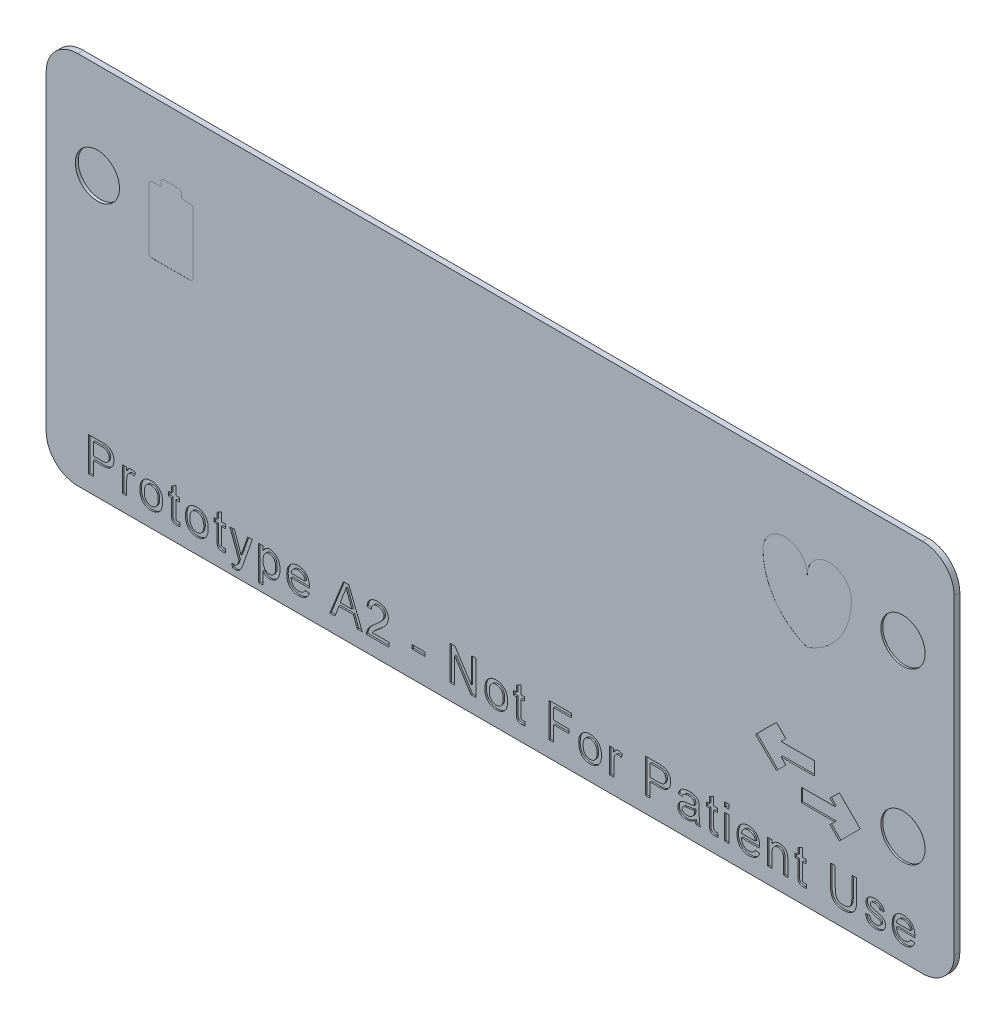
from build123d import *

# Parameters (mm, degrees)
BOSS_EXTRUDE1_DEPTH          = 0.381
SKETCH2_R                    = 1.5
CUT_EXTRUDE1_DEPTH           = 0.127
SKETCH17_R                   = 1.5
CUT_EXTRUDE9_DEPTH           = 0.2
HEART_SYM_CUT_EXTRUDE6_DEPTH = 0.005
BATT_SYM_CUT_EXTRUDE7_DEPTH  = 0.005
COMM_SYMCUT_EXTRUDE9_DEPTH   = 0.1
SKETCH16_W                   = 0.859398945
SKETCH16_H                   = 0.266710017
SKETCH16_W_2                 = 0.296344464
SKETCH16_H_2                 = 0.296344464
SKETCH16_H_3                 = 1.689163443
CUT_EXTRUDE10_DEPTH          = 0.1


with BuildPart() as part:
    # Sketch1 → Boss-Extrude1 (new body)
    with BuildSketch(Plane.XY):
        with BuildLine():
            Line((2.14, 0), (59.46, 0))
            ThreePointArc((59.46, 0), (60.973208512, 0.626791488), (61.6, 2.14))
            Line((61.6, 2.14), (61.6, 23.26))
            ThreePointArc((61.6, 23.26), (60.973208512, 24.773208512), (59.46, 25.4))
            Line((59.46, 25.4), (2.14, 25.4))
            ThreePointArc((2.14, 25.4), (0.626791488, 24.773208512), (0, 23.26))
            Line((0, 23.26), (0, 2.14))
            ThreePointArc((0, 2.14), (0.626791488, 0.626791488), (2.14, 0))
        make_face()
    extrude(amount=BOSS_EXTRUDE1_DEPTH)

    # Sketch2 → Cut-Extrude1 (cut)
    with BuildSketch(Plane.XY.offset(0.381)):
        with Locations((58.125, 18.8976)):
            Circle(SKETCH2_R)
        with Locations((58.125, 7.3914)):
            Circle(SKETCH2_R)
    extrude(amount=-CUT_EXTRUDE1_DEPTH, mode=Mode.SUBTRACT)

    # Sketch17 → Cut-Extrude9 (cut)
    with BuildSketch(Plane.XY.offset(0.381)):
        with Locations((3.475, 18.8976)):
            Circle(SKETCH17_R)
    extrude(amount=-CUT_EXTRUDE9_DEPTH, mode=Mode.SUBTRACT)

    # Sketch10 → Heart Sym Cut-Extrude6 (cut)
    with BuildSketch(Plane.XY.offset(0.381)):
        with BuildLine():
            ThreePointArc((51.625, 19.4976), (50.125, 20.9976), (48.625, 19.4976))
            ThreePointArc((48.625, 19.4976), (49.450765386, 16.899523789), (51.625, 15.254959313))
            ThreePointArc((51.625, 15.254959313), (53.799234614, 16.899523789), (54.625, 19.4976))
            ThreePointArc((54.625, 19.4976), (53.125, 20.9976), (51.625, 19.4976))
        make_face()
    extrude(amount=-HEART_SYM_CUT_EXTRUDE6_DEPTH, mode=Mode.SUBTRACT)

    # Sketch11 → Batt Sym Cut-Extrude7 (cut)
    with BuildSketch(Plane.XY.offset(0.381)):
        with BuildLine():
            Line((7.175, 20.3976), (7.775, 20.3976))
            Line((7.775, 20.3976), (7.775, 20.6976))
            ThreePointArc((7.775, 20.6976), (7.833578644, 20.839021356), (7.975, 20.8976))
            Line((7.975, 20.8976), (8.975, 20.8976))
            ThreePointArc((8.975, 20.8976), (9.116421356, 20.839021356), (9.175, 20.6976))
            Line((9.175, 20.6976), (9.175, 20.3976))
            Line((9.175, 20.3976), (9.775, 20.3976))
            ThreePointArc((9.775, 20.3976), (9.916421356, 20.339021356), (9.975, 20.1976))
            Line((9.975, 20.1976), (9.975, 16.0976))
            ThreePointArc((9.975, 16.0976), (9.916421356, 15.956178644), (9.775, 15.8976))
            Line((9.775, 15.8976), (7.175, 15.8976))
            ThreePointArc((7.175, 15.8976), (7.033578644, 15.956178644), (6.975, 16.0976))
            Line((6.975, 16.0976), (6.975, 20.1976))
            ThreePointArc((6.975, 20.1976), (7.033578644, 20.339021356), (7.175, 20.3976))
        make_face()
    extrude(amount=-BATT_SYM_CUT_EXTRUDE7_DEPTH, mode=Mode.SUBTRACT)

    # Sketch13 → Comm SymCut-Extrude9 (cut)
    with BuildSketch(Plane.XY.offset(0.381)):
        Polygon((53.810786438, 7.805613562), (53.174390335, 7.169217459), (53.502207794, 6.8414), (51.225, 6.8414), (51.225, 5.9414), (53.502207794, 5.9414), (53.174390335, 5.613582541), (53.810786438, 4.977186438), (55.225, 6.3914), align=None)
        Polygon((49.847792206, 7.9414), (50.175609665, 7.613582541), (49.539213562, 6.977186438), (48.125, 8.3914), (49.539213562, 9.805613562), (50.175609665, 9.169217459), (49.847792206, 8.8414), (52.125, 8.8414), (52.125, 7.9414), align=None)
    extrude(amount=-COMM_SYMCUT_EXTRUDE9_DEPTH, mode=Mode.SUBTRACT)

    # Sketch16 → Cut-Extrude10 (cut)
    # profile 1 of 29: a face of its own
    with BuildSketch(Plane.XY.offset(0.381)):
        with BuildLine():
            Line((2.878051765, 1.073708246), (2.878051765, 3.385195063))
            Line((2.878051765, 3.385195063), (3.727263869, 3.385195063))
            add(Edge.make_bspline(
                [(3.727263869, 3.385195063), (3.762463026, 3.38499453), (3.828567208, 3.384617929), (3.920880849, 3.380207448), (4.000152073, 3.374750953), (4.04803221, 3.366982323), (4.069912155, 3.363432266)],
                knots=[0, 0, 0, 0, 1.22865052, 2.30741144, 3.226532197, 4, 4, 4, 4], degree=3))
            add(Edge.make_bspline(
                [(4.069912155, 3.363432266), (4.096600406, 3.358296052), (4.148329675, 3.348340639), (4.221570303, 3.324340296), (4.288296758, 3.294473702), (4.348404759, 3.257263008), (4.402892885, 3.213549543), (4.45098462, 3.161170551), (4.493614313, 3.101295563), (4.529862574, 3.033971426), (4.560033697, 2.961530684), (4.58116567, 2.884356228), (4.594700736, 2.803788859), (4.596125392, 2.74872726), (4.596849654, 2.72073521)],
                knots=[0, 0, 0, 0, 1.070909925, 2.075721949, 3.031861647, 3.947440733, 4.85625699, 5.777986723, 6.742441087, 7.747548058, 8.78749499, 9.830146138, 10.896896232, 12, 12, 12, 12], degree=3))
            add(Edge.make_bspline(
                [(4.596849654, 2.72073521), (4.596339237, 2.696785223), (4.595334962, 2.649662311), (4.586711417, 2.580431953), (4.573110223, 2.513829534), (4.552822197, 2.450310824), (4.52801954, 2.389133227), (4.496762462, 2.331328519), (4.460263013, 2.276111759), (4.418386818, 2.223633199), (4.369086906, 2.174957746), (4.309773052, 2.133666193), (4.241588831, 2.098992897), (4.164518342, 2.070977248), (4.078748675, 2.048933447), (3.983998802, 2.032782268), (3.880084149, 2.023865473), (3.807849227, 2.022644678), (3.770326423, 2.02201053)],
                knots=[0, 0, 0, 0, 0.928769099, 1.82740408, 2.702266355, 3.562020322, 4.410419678, 5.259600434, 6.10654066, 6.975254961, 7.860221694, 8.783881459, 9.766664779, 10.81996744, 11.958551584, 13.197863772, 14.544415867, 16, 16, 16, 16], degree=3))
            Line((3.770326423, 2.02201053), (3.204030675, 2.02201053))
            Line((3.204030675, 2.02201053), (3.204030675, 1.073708246))
            Line((3.204030675, 1.073708246), (2.878051765, 1.073708246))
        make_face()
        with BuildLine():
            Line((3.204030675, 2.288720547), (3.761528697, 2.288720547))
            add(Edge.make_bspline(
                [(3.761528697, 2.288720547), (3.783763909, 2.289092328), (3.826597984, 2.28980853), (3.888491269, 2.294806577), (3.945294032, 2.303457965), (3.997163839, 2.315524119), (4.044166736, 2.330522002), (4.086218628, 2.349490196), (4.123102663, 2.372243622), (4.155063247, 2.398550422), (4.182497801, 2.428020455), (4.20626919, 2.460170635), (4.226466647, 2.495230711), (4.242299066, 2.533347371), (4.255711308, 2.573779172), (4.264082969, 2.617363863), (4.269903758, 2.663469403), (4.270543896, 2.695248404), (4.270870744, 2.711474446)],
                knots=[0, 0, 0, 0, 1.403696362, 2.704090955, 3.91683431, 5.027708188, 6.063065288, 7.026749679, 7.932587242, 8.790956304, 9.632005367, 10.468072405, 11.310475089, 12.179234342, 13.069796908, 13.994719932, 14.976123913, 16, 16, 16, 16], degree=3))
            add(Edge.make_bspline(
                [(4.270870744, 2.711474446), (4.270180233, 2.735004795), (4.268842263, 2.780598396), (4.255361883, 2.846206183), (4.234227494, 2.906828942), (4.20396927, 2.961318893), (4.167348017, 3.009121092), (4.12430051, 3.04823116), (4.076206865, 3.079498218), (4.040297862, 3.091878448), (4.022219218, 3.098111363)],
                knots=[0, 0, 0, 0, 1.143156811, 2.215038775, 3.243253804, 4.254666983, 5.233799895, 6.158487526, 7.072877374, 8, 8, 8, 8], degree=3))
            add(Edge.make_bspline(
                [(4.022219218, 3.098111363), (4.015598239, 3.099730339), (4.001210396, 3.103248484), (3.977377048, 3.107241632), (3.949755453, 3.111022789), (3.918210969, 3.11353141), (3.883031276, 3.116022791), (3.844108823, 3.117171255), (3.801354947, 3.1181632), (3.771561983, 3.118374486), (3.755972238, 3.118485045)],
                knots=[0, 0, 0, 0, 0.611063981, 1.327884044, 2.165719042, 3.110592661, 4.16481496, 5.328235826, 6.601947678, 8, 8, 8, 8], degree=3))
            Line((3.755972238, 3.118485045), (3.204030675, 3.118485045))
            Line((3.204030675, 3.118485045), (3.204030675, 2.288720547))
        make_face(mode=Mode.SUBTRACT)
    # profile 2 of 29: a face of its own
    with BuildSketch(Plane.XY.offset(0.381)):
        with BuildLine():
            Line((5.165831024, 1.073708246), (5.165831024, 2.762871689))
            Line((5.165831024, 2.762871689), (5.432541042, 2.762871689))
            Line((5.432541042, 2.762871689), (5.432541042, 2.527185233))
            add(Edge.make_bspline(
                [(5.432541042, 2.527185233), (5.447459851, 2.552113796), (5.475098947, 2.598297307), (5.518690926, 2.659155318), (5.56016821, 2.706819796), (5.602038866, 2.740782609), (5.643939943, 2.764287618), (5.686725827, 2.780469545), (5.731489946, 2.790748894), (5.762014311, 2.791914583), (5.777504519, 2.792506135)],
                knots=[0, 0, 0, 0, 1.517336028, 2.811068648, 3.907416798, 4.807929446, 5.613162482, 6.406966847, 7.191583018, 8, 8, 8, 8], degree=3))
            add(Edge.make_bspline(
                [(5.777504519, 2.792506135), (5.800430611, 2.791482981), (5.846899059, 2.789409169), (5.916524351, 2.773493555), (5.986973418, 2.74936328), (6.031844091, 2.725545835), (6.054864415, 2.713326599)],
                knots=[0, 0, 0, 0, 0.943117096, 1.911585642, 2.928565726, 4, 4, 4, 4], degree=3))
            Line((6.054864415, 2.713326599), (5.96225677, 2.456340384))
            add(Edge.make_bspline(
                [(5.96225677, 2.456340384), (5.946179063, 2.467030178), (5.915171569, 2.487646533), (5.865452502, 2.509481458), (5.815773465, 2.523417558), (5.782375815, 2.525011268), (5.765928563, 2.525796118)],
                knots=[0, 0, 0, 0, 1.093324321, 2.108587182, 3.068540977, 4, 4, 4, 4], degree=3))
            add(Edge.make_bspline(
                [(5.765928563, 2.525796118), (5.751661695, 2.525071338), (5.723492295, 2.523640287), (5.682333294, 2.512525021), (5.643609856, 2.49415447), (5.607351831, 2.469094069), (5.575104144, 2.437417543), (5.546800873, 2.400371422), (5.523929086, 2.357304987), (5.513426236, 2.325790313), (5.508016272, 2.309557267)],
                knots=[0, 0, 0, 0, 0.946345552, 1.868524143, 2.808299705, 3.780481321, 4.780563855, 5.797153696, 6.865325266, 8, 8, 8, 8], degree=3))
            add(Edge.make_bspline(
                [(5.508016272, 2.309557267), (5.500951064, 2.283259837), (5.486606639, 2.229868411), (5.472833655, 2.146789568), (5.46352146, 2.060193399), (5.462630461, 2.001200173), (5.462175488, 1.971076325)],
                knots=[0, 0, 0, 0, 0.953038166, 1.934944501, 2.945515915, 4, 4, 4, 4], degree=3))
            Line((5.462175488, 1.971076325), (5.462175488, 1.073708246))
            Line((5.462175488, 1.073708246), (5.165831024, 1.073708246))
        make_face()
    # profile 3 of 29: a face of its own
    with BuildSketch(Plane.XY.offset(0.381)):
        with BuildLine():
            add(Edge.make_bspline(
                [(6.357135768, 1.918289968), (6.357965589, 1.955825144), (6.359571352, 2.028458453), (6.371070045, 2.133854976), (6.390783717, 2.231704483), (6.41844915, 2.322098877), (6.45422604, 2.405066636), (6.498423865, 2.480142262), (6.549823658, 2.548705024), (6.590843622, 2.58745975), (6.611343753, 2.606827807)],
                knots=[0, 0, 0, 0, 1.189940866, 2.302622481, 3.356378305, 4.350088409, 5.294652018, 6.213657312, 7.107257627, 8, 8, 8, 8], degree=3))
            add(Edge.make_bspline(
                [(6.611343753, 2.606827807), (6.629273822, 2.621712337), (6.664806801, 2.651209806), (6.722803223, 2.688617198), (6.783183953, 2.720756566), (6.846482537, 2.747405011), (6.912899023, 2.767765386), (6.982226597, 2.781896395), (7.054376645, 2.791128512), (7.103524202, 2.792041239), (7.12855745, 2.792506135)],
                knots=[0, 0, 0, 0, 0.994414631, 1.970684744, 2.940793954, 3.912782355, 4.898970837, 5.902128985, 6.931451948, 8, 8, 8, 8], degree=3))
            add(Edge.make_bspline(
                [(7.12855745, 2.792506135), (7.156210384, 2.791725951), (7.210318475, 2.790199376), (7.28971919, 2.780244444), (7.36490622, 2.761744646), (7.436847688, 2.737498773), (7.50445423, 2.705187073), (7.568793664, 2.666664902), (7.628290564, 2.619979134), (7.684085228, 2.567209713), (7.734418492, 2.508196123), (7.778270887, 2.443228326), (7.815407595, 2.372867542), (7.846084561, 2.297047065), (7.869610605, 2.215713895), (7.886008857, 2.129041841), (7.896513697, 2.03724084), (7.897580597, 1.974193018), (7.898126979, 1.941904917)],
                knots=[0, 0, 0, 0, 1.026363227, 2.008269884, 2.962742747, 3.895658536, 4.820662428, 5.738204837, 6.673158329, 7.621267452, 8.584296177, 9.545483285, 10.524327568, 11.531652541, 12.575780624, 13.660990097, 14.802144351, 16, 16, 16, 16], degree=3))
            add(Edge.make_bspline(
                [(7.898126979, 1.941904917), (7.897921112, 1.915658127), (7.89752114, 1.864664129), (7.892686396, 1.790361469), (7.885380364, 1.720368706), (7.875436687, 1.65460618), (7.862042074, 1.593179334), (7.845338811, 1.536137488), (7.825968006, 1.483172576), (7.80370478, 1.434228066), (7.778301521, 1.388908581), (7.750626584, 1.346237332), (7.719984279, 1.306279055), (7.686413884, 1.269099974), (7.65036841, 1.234430448), (7.611601917, 1.202139048), (7.570042846, 1.172690662), (7.511369723, 1.136936388), (7.433928503, 1.099469787), (7.335845319, 1.067361698), (7.23351853, 1.047792015), (7.163834013, 1.045323462), (7.12855745, 1.0440738)],
                knots=[0, 0, 0, 0, 1.174068422, 2.28105775, 3.329581501, 4.321819531, 5.255045276, 6.14001734, 6.978936381, 7.776151739, 8.542754425, 9.301196708, 10.049767304, 10.792968067, 11.540167917, 12.285482871, 13.048063169, 13.816653646, 15.357768987, 16.884132754, 18.422646949, 20, 20, 20, 20], degree=3))
            add(Edge.make_bspline(
                [(7.12855745, 1.0440738), (7.100436792, 1.04483647), (7.045396783, 1.046329231), (6.964873078, 1.05651413), (6.888451168, 1.073966034), (6.816361578, 1.099398291), (6.747961801, 1.130617592), (6.683898205, 1.16959005), (6.624047001, 1.215466491), (6.568936762, 1.268542879), (6.51854757, 1.327636573), (6.475534, 1.394016423), (6.438719641, 1.466313305), (6.408642377, 1.544839019), (6.385667542, 1.629595928), (6.369168784, 1.720360903), (6.35873997, 1.817258723), (6.357680272, 1.883997596), (6.357135768, 1.918289968)],
                knots=[0, 0, 0, 0, 1.022681766, 2.001674804, 2.94671416, 3.868132449, 4.777362857, 5.676573364, 6.589418535, 7.514523194, 8.454681358, 9.407574523, 10.384198733, 11.400667853, 12.460217505, 13.573389442, 14.753137007, 16, 16, 16, 16], degree=3))
        make_face()
        with BuildLine():
            add(Edge.make_bspline(
                [(6.653480232, 1.919216044), (6.653983149, 1.894510307), (6.654955958, 1.846721217), (6.660761743, 1.777357084), (6.671367844, 1.71296086), (6.686123369, 1.653298591), (6.705049069, 1.598361817), (6.728244629, 1.548057527), (6.75545699, 1.502343077), (6.787276634, 1.461963717), (6.821907252, 1.426272845), (6.859259254, 1.39548664), (6.898813189, 1.369345316), (6.94063628, 1.348030436), (6.984539131, 1.331189766), (7.030617264, 1.319064177), (7.078952392, 1.312101632), (7.111866012, 1.311227244), (7.12855745, 1.310783817)],
                knots=[0, 0, 0, 0, 1.36128903, 2.633184439, 3.831299874, 4.953299848, 6.015607462, 7.027679361, 8.000438392, 8.93945591, 9.853536715, 10.73548639, 11.60109037, 12.460616037, 13.316600729, 14.187036799, 15.080594522, 16, 16, 16, 16], degree=3))
            add(Edge.make_bspline(
                [(7.12855745, 1.310783817), (7.145105454, 1.311161977), (7.17775632, 1.311908123), (7.225462231, 1.319807627), (7.271375011, 1.331140258), (7.315115322, 1.347862215), (7.356319234, 1.369919994), (7.395785201, 1.39601142), (7.432713264, 1.427248048), (7.467740079, 1.462870535), (7.499105063, 1.503845702), (7.527238585, 1.549379106), (7.550353642, 1.600500416), (7.569040612, 1.656426804), (7.583959547, 1.717277341), (7.594516257, 1.783075266), (7.60028814, 1.853978626), (7.601274499, 1.902845356), (7.601782515, 1.92801377)],
                knots=[0, 0, 0, 0, 0.904535546, 1.784739026, 2.638791991, 3.488785886, 4.338695884, 5.191202824, 6.07237792, 6.980061329, 7.919174549, 8.889507933, 9.902165842, 10.981000531, 12.111539881, 13.326270405, 14.622917219, 16, 16, 16, 16], degree=3))
            add(Edge.make_bspline(
                [(7.601782515, 1.92801377), (7.601270217, 1.951792657), (7.60027388, 1.998038719), (7.59453308, 2.065260567), (7.583790659, 2.127923063), (7.569322112, 2.186202827), (7.549489319, 2.23961996), (7.526700746, 2.289187143), (7.498567167, 2.333921287), (7.466649947, 2.374074716), (7.43181364, 2.409808656), (7.394792487, 2.441168856), (7.355200845, 2.466922905), (7.313992526, 2.488818133), (7.270500133, 2.505177979), (7.225134678, 2.517553109), (7.177546628, 2.524492559), (7.145094029, 2.525356094), (7.12855745, 2.525796118)],
                knots=[0, 0, 0, 0, 1.329905342, 2.586449315, 3.768451236, 4.882143757, 5.938857988, 6.950440627, 7.927559667, 8.885972819, 9.813736587, 10.714405609, 11.592966897, 12.450023853, 13.318821862, 14.185602452, 15.075453733, 16, 16, 16, 16], degree=3))
            add(Edge.make_bspline(
                [(7.12855745, 2.525796118), (7.11186743, 2.525349009), (7.078956606, 2.524467361), (7.030601134, 2.517557638), (6.98465027, 2.505252702), (6.940523703, 2.489146261), (6.898855033, 2.467626502), (6.859072028, 2.441628693), (6.822233606, 2.410259251), (6.787079112, 2.375120336), (6.755624524, 2.334736414), (6.72822695, 2.289481383), (6.704956796, 2.239491451), (6.686136909, 2.18466559), (6.671363923, 2.125009621), (6.660762636, 2.060611551), (6.654969632, 1.991401815), (6.653986796, 1.943767339), (6.653480232, 1.919216044)],
                knots=[0, 0, 0, 0, 0.920966903, 1.816042154, 2.687956485, 3.542385364, 4.403370762, 5.270444796, 6.159337503, 7.068888003, 8.009500254, 8.976623456, 9.982690403, 11.046802133, 12.170707598, 13.370857791, 14.644913259, 16, 16, 16, 16], degree=3))
        make_face(mode=Mode.SUBTRACT)
    # profile 4 of 29: a face of its own
    with BuildSketch(Plane.XY.offset(0.381)):
        with BuildLine():
            Line((9.059797276, 1.318192429), (9.089431723, 1.069540902))
            add(Edge.make_bspline(
                [(9.089431723, 1.069540902), (9.070483287, 1.065626323), (9.033808197, 1.058049575), (8.979979023, 1.050481283), (8.929345613, 1.044699262), (8.896514418, 1.044277987), (8.880601484, 1.0440738)],
                knots=[0, 0, 0, 0, 1.101333134, 2.13165308, 3.094431941, 4, 4, 4, 4], degree=3))
            add(Edge.make_bspline(
                [(8.880601484, 1.0440738), (8.856962174, 1.044718721), (8.812281095, 1.045937698), (8.749207955, 1.054296126), (8.694497158, 1.069466186), (8.647694202, 1.090330128), (8.608832281, 1.116712908), (8.576135682, 1.146823234), (8.549666356, 1.180722142), (8.532126895, 1.212628627), (8.521801862, 1.242368711), (8.514978593, 1.270101233), (8.509764707, 1.303449556), (8.504557368, 1.341852308), (8.500910305, 1.385895584), (8.499008292, 1.435177939), (8.496785988, 1.489961382), (8.496757648, 1.52825458), (8.496742796, 1.548322426)],
                knots=[0, 0, 0, 0, 1.515965932, 2.865354161, 4.068592833, 5.144966063, 6.135994557, 7.067504024, 7.984224584, 8.88319335, 9.387210378, 9.999362939, 10.71208193, 11.550605788, 12.484373718, 13.544606854, 14.713232298, 16, 16, 16, 16], degree=3))
            Line((8.496742796, 1.548322426), (8.496742796, 2.496161672))
            Line((8.496742796, 2.496161672), (8.289301671, 2.496161672))
            Line((8.289301671, 2.496161672), (8.289301671, 2.762871689))
            Line((8.289301671, 2.762871689), (8.496742796, 2.762871689))
            Line((8.496742796, 2.762871689), (8.496742796, 3.174049632))
            Line((8.496742796, 3.174049632), (8.793087259, 3.342595546))
            Line((8.793087259, 3.342595546), (8.793087259, 2.762871689))
            Line((8.793087259, 2.762871689), (9.059797276, 2.762871689))
            Line((9.059797276, 2.762871689), (9.059797276, 2.496161672))
            Line((9.059797276, 2.496161672), (8.793087259, 2.496161672))
            Line((8.793087259, 2.496161672), (8.793087259, 1.537672547))
            add(Edge.make_bspline(
                [(8.793087259, 1.537672547), (8.793200876, 1.519607926), (8.793405947, 1.487002437), (8.796233088, 1.443428766), (8.799725345, 1.410339444), (8.807076274, 1.380379059), (8.824260462, 1.353206753), (8.847186727, 1.332587529), (8.870469688, 1.320914184), (8.89205729, 1.315293056), (8.916742933, 1.311547646), (8.934297482, 1.311047914), (8.943574682, 1.310783817)],
                knots=[0, 0, 0, 0, 1.693748017, 3.05710712, 4.093010578, 4.8128101, 5.929870973, 7.047775512, 7.662723095, 8.354621928, 9.130453249, 10, 10, 10, 10], degree=3))
            add(Edge.make_bspline(
                [(8.943574682, 1.310783817), (8.951447949, 1.31088646), (8.968439518, 1.311107976), (8.995764794, 1.312628028), (9.026642716, 1.314910353), (9.048379977, 1.317062194), (9.059797276, 1.318192429)],
                knots=[0, 0, 0, 0, 0.810958033, 1.750156657, 2.818290096, 4, 4, 4, 4], degree=3))
        make_face()
    # profile 5 of 29: a face of its own
    with BuildSketch(Plane.XY.offset(0.381)):
        with BuildLine():
            add(Edge.make_bspline(
                [(9.450971968, 1.918289968), (9.451801789, 1.955825144), (9.453407552, 2.028458453), (9.464906246, 2.133854976), (9.484619917, 2.231704483), (9.512285351, 2.322098877), (9.54806224, 2.405066636), (9.592260065, 2.480142262), (9.643659858, 2.548705024), (9.684679822, 2.58745975), (9.705179954, 2.606827807)],
                knots=[0, 0, 0, 0, 1.189940866, 2.302622481, 3.356378305, 4.350088409, 5.294652018, 6.213657312, 7.107257627, 8, 8, 8, 8], degree=3))
            add(Edge.make_bspline(
                [(9.705179954, 2.606827807), (9.723110023, 2.621712337), (9.758643001, 2.651209806), (9.816639423, 2.688617198), (9.877020154, 2.720756566), (9.940318737, 2.747405011), (10.006735224, 2.767765386), (10.076062797, 2.781896395), (10.148212845, 2.791128512), (10.197360402, 2.792041239), (10.22239365, 2.792506135)],
                knots=[0, 0, 0, 0, 0.994414631, 1.970684744, 2.940793954, 3.912782355, 4.898970837, 5.902128985, 6.931451948, 8, 8, 8, 8], degree=3))
            add(Edge.make_bspline(
                [(10.22239365, 2.792506135), (10.250046585, 2.791725951), (10.304154675, 2.790199376), (10.38355539, 2.780244444), (10.458742421, 2.761744646), (10.530683889, 2.737498773), (10.598290431, 2.705187073), (10.662629865, 2.666664902), (10.722126764, 2.619979134), (10.777921428, 2.567209713), (10.828254692, 2.508196123), (10.872107088, 2.443228326), (10.909243796, 2.372867542), (10.939920762, 2.297047065), (10.963446806, 2.215713895), (10.979845057, 2.129041841), (10.990349897, 2.03724084), (10.991416798, 1.974193018), (10.991963179, 1.941904917)],
                knots=[0, 0, 0, 0, 1.026363227, 2.008269884, 2.962742747, 3.895658536, 4.820662428, 5.738204837, 6.673158329, 7.621267452, 8.584296177, 9.545483285, 10.524327568, 11.531652541, 12.575780624, 13.660990097, 14.802144351, 16, 16, 16, 16], degree=3))
            add(Edge.make_bspline(
                [(10.991963179, 1.941904917), (10.991757312, 1.915658127), (10.99135734, 1.864664129), (10.986522597, 1.790361469), (10.979216564, 1.720368706), (10.969272887, 1.65460618), (10.955878275, 1.593179334), (10.939175011, 1.536137488), (10.919804207, 1.483172576), (10.89754098, 1.434228066), (10.872137721, 1.388908581), (10.844462784, 1.346237332), (10.813820479, 1.306279055), (10.780250085, 1.269099974), (10.744204611, 1.234430448), (10.705438118, 1.202139048), (10.663879047, 1.172690662), (10.605205923, 1.136936388), (10.527764703, 1.099469787), (10.42968152, 1.067361698), (10.32735473, 1.047792015), (10.257670213, 1.045323462), (10.22239365, 1.0440738)],
                knots=[0, 0, 0, 0, 1.174068422, 2.28105775, 3.329581501, 4.321819531, 5.255045276, 6.14001734, 6.978936381, 7.776151739, 8.542754425, 9.301196708, 10.049767304, 10.792968067, 11.540167917, 12.285482871, 13.048063169, 13.816653646, 15.357768987, 16.884132754, 18.422646949, 20, 20, 20, 20], degree=3))
            add(Edge.make_bspline(
                [(10.22239365, 1.0440738), (10.194272992, 1.04483647), (10.139232983, 1.046329231), (10.058709279, 1.05651413), (9.982287368, 1.073966034), (9.910197778, 1.099398291), (9.841798002, 1.130617592), (9.777734406, 1.16959005), (9.717883201, 1.215466491), (9.662772962, 1.268542879), (9.61238377, 1.327636573), (9.5693702, 1.394016423), (9.532555842, 1.466313305), (9.502478577, 1.544839019), (9.479503743, 1.629595928), (9.463004985, 1.720360903), (9.452576171, 1.817258723), (9.451516472, 1.883997596), (9.450971968, 1.918289968)],
                knots=[0, 0, 0, 0, 1.022681766, 2.001674804, 2.94671416, 3.868132449, 4.777362857, 5.676573364, 6.589418535, 7.514523194, 8.454681358, 9.407574523, 10.384198733, 11.400667853, 12.460217505, 13.573389442, 14.753137007, 16, 16, 16, 16], degree=3))
        make_face()
        with BuildLine():
            add(Edge.make_bspline(
                [(9.747316432, 1.919216044), (9.747819349, 1.894510307), (9.748792158, 1.846721217), (9.754597944, 1.777357084), (9.765204044, 1.71296086), (9.779959569, 1.653298591), (9.79888527, 1.598361817), (9.822080829, 1.548057527), (9.84929319, 1.502343077), (9.881112835, 1.461963717), (9.915743452, 1.426272845), (9.953095455, 1.39548664), (9.99264939, 1.369345316), (10.03447248, 1.348030436), (10.078375331, 1.331189766), (10.124453464, 1.319064177), (10.172788592, 1.312101632), (10.205702213, 1.311227244), (10.22239365, 1.310783817)],
                knots=[0, 0, 0, 0, 1.36128903, 2.633184439, 3.831299874, 4.953299848, 6.015607462, 7.027679361, 8.000438392, 8.93945591, 9.853536715, 10.73548639, 11.60109037, 12.460616037, 13.316600729, 14.187036799, 15.080594522, 16, 16, 16, 16], degree=3))
            add(Edge.make_bspline(
                [(10.22239365, 1.310783817), (10.238941654, 1.311161977), (10.27159252, 1.311908123), (10.319298432, 1.319807627), (10.365211211, 1.331140258), (10.408951523, 1.347862215), (10.450155434, 1.369919994), (10.489621402, 1.39601142), (10.526549464, 1.427248048), (10.56157628, 1.462870535), (10.592941263, 1.503845702), (10.621074785, 1.549379106), (10.644189842, 1.600500416), (10.662876812, 1.656426804), (10.677795748, 1.717277341), (10.688352458, 1.783075266), (10.69412434, 1.853978626), (10.695110699, 1.902845356), (10.695618716, 1.92801377)],
                knots=[0, 0, 0, 0, 0.904535546, 1.784739026, 2.638791991, 3.488785886, 4.338695884, 5.191202824, 6.07237792, 6.980061329, 7.919174549, 8.889507933, 9.902165842, 10.981000531, 12.111539881, 13.326270405, 14.622917219, 16, 16, 16, 16], degree=3))
            add(Edge.make_bspline(
                [(10.695618716, 1.92801377), (10.695106417, 1.951792657), (10.69411008, 1.998038719), (10.688369281, 2.065260567), (10.67762686, 2.127923063), (10.663158312, 2.186202827), (10.643325519, 2.23961996), (10.620536947, 2.289187143), (10.592403367, 2.333921287), (10.560486147, 2.374074716), (10.52564984, 2.409808656), (10.488628687, 2.441168856), (10.449037045, 2.466922905), (10.407828726, 2.488818133), (10.364336333, 2.505177979), (10.318970878, 2.517553109), (10.271382829, 2.524492559), (10.23893023, 2.525356094), (10.22239365, 2.525796118)],
                knots=[0, 0, 0, 0, 1.329905342, 2.586449315, 3.768451236, 4.882143757, 5.938857988, 6.950440627, 7.927559667, 8.885972819, 9.813736587, 10.714405609, 11.592966897, 12.450023853, 13.318821862, 14.185602452, 15.075453733, 16, 16, 16, 16], degree=3))
            add(Edge.make_bspline(
                [(10.22239365, 2.525796118), (10.205703631, 2.525349009), (10.172792806, 2.524467361), (10.124437335, 2.517557638), (10.07848647, 2.505252702), (10.034359903, 2.489146261), (9.992691234, 2.467626502), (9.952908229, 2.441628693), (9.916069807, 2.410259251), (9.880915313, 2.375120336), (9.849460724, 2.334736414), (9.82206315, 2.289481383), (9.798792996, 2.239491451), (9.77997311, 2.18466559), (9.765200123, 2.125009621), (9.754598836, 2.060611551), (9.748805833, 1.991401815), (9.747822996, 1.943767339), (9.747316432, 1.919216044)],
                knots=[0, 0, 0, 0, 0.920966903, 1.816042154, 2.687956485, 3.542385364, 4.403370762, 5.270444796, 6.159337503, 7.068888003, 8.009500254, 8.976623456, 9.982690403, 11.046802133, 12.170707598, 13.370857791, 14.644913259, 16, 16, 16, 16], degree=3))
        make_face(mode=Mode.SUBTRACT)
    # profile 6 of 29: a face of its own
    with BuildSketch(Plane.XY.offset(0.381)):
        with BuildLine():
            Line((12.153633477, 1.318192429), (12.183267923, 1.069540902))
            add(Edge.make_bspline(
                [(12.183267923, 1.069540902), (12.164319487, 1.065626323), (12.127644397, 1.058049575), (12.073815224, 1.050481283), (12.023181813, 1.044699262), (11.990350618, 1.044277987), (11.974437684, 1.0440738)],
                knots=[0, 0, 0, 0, 1.101333134, 2.13165308, 3.094431941, 4, 4, 4, 4], degree=3))
            add(Edge.make_bspline(
                [(11.974437684, 1.0440738), (11.950798375, 1.044718721), (11.906117296, 1.045937698), (11.843044155, 1.054296126), (11.788333359, 1.069466186), (11.741530402, 1.090330128), (11.702668482, 1.116712908), (11.669971883, 1.146823234), (11.643502557, 1.180722142), (11.625963095, 1.212628627), (11.615638062, 1.242368711), (11.608814794, 1.270101233), (11.603600907, 1.303449556), (11.598393568, 1.341852308), (11.594746506, 1.385895584), (11.592844492, 1.435177939), (11.590622189, 1.489961382), (11.590593848, 1.52825458), (11.590578996, 1.548322426)],
                knots=[0, 0, 0, 0, 1.515965932, 2.865354161, 4.068592833, 5.144966063, 6.135994557, 7.067504024, 7.984224584, 8.88319335, 9.387210378, 9.999362939, 10.71208193, 11.550605788, 12.484373718, 13.544606854, 14.713232298, 16, 16, 16, 16], degree=3))
            Line((11.590578996, 1.548322426), (11.590578996, 2.496161672))
            Line((11.590578996, 2.496161672), (11.383137871, 2.496161672))
            Line((11.383137871, 2.496161672), (11.383137871, 2.762871689))
            Line((11.383137871, 2.762871689), (11.590578996, 2.762871689))
            Line((11.590578996, 2.762871689), (11.590578996, 3.174049632))
            Line((11.590578996, 3.174049632), (11.88692346, 3.342595546))
            Line((11.88692346, 3.342595546), (11.88692346, 2.762871689))
            Line((11.88692346, 2.762871689), (12.153633477, 2.762871689))
            Line((12.153633477, 2.762871689), (12.153633477, 2.496161672))
            Line((12.153633477, 2.496161672), (11.88692346, 2.496161672))
            Line((11.88692346, 2.496161672), (11.88692346, 1.537672547))
            add(Edge.make_bspline(
                [(11.88692346, 1.537672547), (11.887037076, 1.519607926), (11.887242148, 1.487002437), (11.890069288, 1.443428766), (11.893561545, 1.410339444), (11.900912475, 1.380379059), (11.918096662, 1.353206753), (11.941022928, 1.332587529), (11.964305888, 1.320914184), (11.985893491, 1.315293056), (12.010579133, 1.311547646), (12.028133683, 1.311047914), (12.037410883, 1.310783817)],
                knots=[0, 0, 0, 0, 1.693748017, 3.05710712, 4.093010578, 4.8128101, 5.929870973, 7.047775512, 7.662723095, 8.354621928, 9.130453249, 10, 10, 10, 10], degree=3))
            add(Edge.make_bspline(
                [(12.037410883, 1.310783817), (12.045284149, 1.31088646), (12.062275718, 1.311107976), (12.089600994, 1.312628028), (12.120478916, 1.314910353), (12.142216177, 1.317062194), (12.153633477, 1.318192429)],
                knots=[0, 0, 0, 0, 0.810958033, 1.750156657, 2.818290096, 4, 4, 4, 4], degree=3))
        make_face()
    # profile 7 of 29: a face of its own
    with BuildSketch(Plane.XY.offset(0.381)):
        with BuildLine():
            Line((12.633711508, 0.455089178), (12.604077062, 0.713464508))
            add(Edge.make_bspline(
                [(12.604077062, 0.713464508), (12.617755174, 0.709504168), (12.643976085, 0.701912205), (12.682821089, 0.695016896), (12.718580383, 0.68912774), (12.741732038, 0.688675113), (12.752712332, 0.688460443)],
                knots=[0, 0, 0, 0, 1.12915394, 2.164585651, 3.129505495, 4, 4, 4, 4], degree=3))
            add(Edge.make_bspline(
                [(12.752712332, 0.688460443), (12.766320944, 0.68874484), (12.792450373, 0.689290901), (12.829309255, 0.695323072), (12.86221916, 0.704905023), (12.89068389, 0.719188371), (12.916345723, 0.736390054), (12.938189508, 0.757826699), (12.959396296, 0.780776017), (12.970323285, 0.798754246), (12.975896756, 0.807924305)],
                knots=[0, 0, 0, 0, 1.222547858, 2.347372026, 3.34834, 4.291755468, 5.200225115, 6.113347104, 7.037685039, 8, 8, 8, 8], degree=3))
            add(Edge.make_bspline(
                [(12.975896756, 0.807924305), (12.97808287, 0.812078616), (12.983130636, 0.821670971), (12.990917707, 0.83810646), (12.999203031, 0.858740497), (13.008219952, 0.883277466), (13.019249881, 0.911429525), (13.029867921, 0.94397453), (13.042805741, 0.979993319), (13.050849622, 1.005609615), (13.055076292, 1.019069736)],
                knots=[0, 0, 0, 0, 0.499056455, 1.152327554, 1.932396574, 2.861927129, 3.931654914, 5.145911677, 6.500314985, 8, 8, 8, 8], degree=3))
            add(Edge.make_bspline(
                [(13.055076292, 1.019069736), (13.058310406, 1.028795937), (13.065964502, 1.051814693), (13.073738806, 1.074793148), (13.078228203, 1.088062431)],
                knots=[0, 0, 0, 0, 0.84506746, 2, 2, 2, 2], degree=3))
            Line((13.078228203, 1.088062431), (12.45590483, 2.762871689))
            Line((12.45590483, 2.762871689), (12.769381708, 2.762871689))
            Line((12.769381708, 2.762871689), (13.100917076, 1.835406125))
            add(Edge.make_bspline(
                [(13.100917076, 1.835406125), (13.122002676, 1.775278421), (13.164873199, 1.653028817), (13.198915027, 1.528030953), (13.216213594, 1.464512508)],
                knots=[0, 0, 0, 0, 0.983687515, 2, 2, 2, 2], degree=3))
            add(Edge.make_bspline(
                [(13.216213594, 1.464512508), (13.224056686, 1.487211366), (13.240556416, 1.53496359), (13.267106112, 1.609866984), (13.295661213, 1.691932911), (13.315886712, 1.748830099), (13.326416692, 1.778452424)],
                knots=[0, 0, 0, 0, 0.866150559, 1.822145229, 2.866145716, 4, 4, 4, 4], degree=3))
            Line((13.326416692, 1.778452424), (13.670917131, 2.762871689))
            Line((13.670917131, 2.762871689), (13.983004894, 2.762871689))
            Line((13.983004894, 2.762871689), (13.377813935, 1.033886959))
            add(Edge.make_bspline(
                [(13.377813935, 1.033886959), (13.369744681, 1.013005431), (13.354266987, 0.972952419), (13.330214491, 0.915990646), (13.308676504, 0.863665128), (13.288461539, 0.816285304), (13.268846548, 0.774357546), (13.251386447, 0.737173359), (13.23530348, 0.705136014), (13.224457615, 0.685802327), (13.219454862, 0.676884488)],
                knots=[0, 0, 0, 0, 1.374607903, 2.636645431, 3.796610243, 4.849482013, 5.799414788, 6.638849055, 7.372156777, 8, 8, 8, 8], degree=3))
            add(Edge.make_bspline(
                [(13.219454862, 0.676884488), (13.206935327, 0.656059141), (13.182856147, 0.616005155), (13.140876402, 0.562843378), (13.096299077, 0.51825526), (13.048421328, 0.482234198), (12.996436445, 0.454990781), (12.940174965, 0.435360923), (12.879142969, 0.423654103), (12.836882743, 0.422395511), (12.815222492, 0.421750426)],
                knots=[0, 0, 0, 0, 1.154647028, 2.220765753, 3.212122198, 4.145795136, 5.058575804, 5.991786985, 6.970701249, 8, 8, 8, 8], degree=3))
            add(Edge.make_bspline(
                [(12.815222492, 0.421750426), (12.801314722, 0.422299916), (12.772612527, 0.423433927), (12.728258474, 0.429620231), (12.68161978, 0.440471916), (12.650018285, 0.450113828), (12.633711508, 0.455089178)],
                knots=[0, 0, 0, 0, 0.901275447, 1.860009393, 2.895737391, 4, 4, 4, 4], degree=3))
        make_face()
    # profile 8 of 29: a face of its own
    with BuildSketch(Plane.XY.offset(0.381)):
        with BuildLine():
            Line((14.417705179, 0.451384872), (14.417705179, 2.762871689))
            Line((14.417705179, 2.762871689), (14.714049643, 2.762871689))
            Line((14.714049643, 2.762871689), (14.714049643, 2.494772557))
            add(Edge.make_bspline(
                [(14.714049643, 2.494772557), (14.728912825, 2.518359982), (14.757544622, 2.563797786), (14.805769545, 2.625113726), (14.857518836, 2.676421469), (14.912262071, 2.719267193), (14.972160918, 2.752107718), (15.037289439, 2.776059593), (15.108582829, 2.790043608), (15.158040663, 2.791667761), (15.183570402, 2.792506135)],
                knots=[0, 0, 0, 0, 1.141868254, 2.199646056, 3.187916027, 4.121412168, 5.038483649, 5.974824485, 6.95462054, 8, 8, 8, 8], degree=3))
            add(Edge.make_bspline(
                [(15.183570402, 2.792506135), (15.200561857, 2.79212778), (15.234157498, 2.791379693), (15.283812726, 2.786105939), (15.332152885, 2.777930553), (15.378952186, 2.765918634), (15.423960196, 2.750096365), (15.467332372, 2.730815152), (15.509540544, 2.708842712), (15.5498326, 2.682745987), (15.587990357, 2.653551861), (15.62456344, 2.6222097), (15.657760279, 2.586987555), (15.689397608, 2.549717738), (15.718165287, 2.509264568), (15.744106162, 2.465735068), (15.768177947, 2.419770922), (15.796521974, 2.354244968), (15.826623399, 2.268292357), (15.851087274, 2.159822755), (15.867040179, 2.046870486), (15.868865651, 1.969897052), (15.869793051, 1.930792)],
                knots=[0, 0, 0, 0, 0.824202902, 1.629620634, 2.419929953, 3.200854495, 3.970497378, 4.731532444, 5.501903467, 6.276628953, 7.056871135, 7.831705169, 8.610184821, 9.402088757, 10.202023236, 11.014889876, 11.858855485, 12.71721399, 14.476656902, 16.267557585, 18.103795699, 20, 20, 20, 20], degree=3))
            add(Edge.make_bspline(
                [(15.869793051, 1.930792), (15.868812534, 1.88905713), (15.866893608, 1.807379684), (15.849300947, 1.688016266), (15.820693974, 1.575009637), (15.787348807, 1.485858516), (15.755384777, 1.418798253), (15.728284849, 1.371952171), (15.699225631, 1.327912045), (15.667587943, 1.286673494), (15.632719288, 1.248907318), (15.595758949, 1.213599557), (15.556224971, 1.181386998), (15.500442766, 1.14371976), (15.427816622, 1.104270999), (15.337051613, 1.069311949), (15.243649989, 1.048215311), (15.180433072, 1.045453782), (15.148842536, 1.0440738)],
                knots=[0, 0, 0, 0, 1.566750505, 3.066217315, 4.520030908, 5.938083948, 6.632957415, 7.30813415, 7.968947793, 8.613647255, 9.257851326, 9.897527079, 10.532192309, 11.170526994, 12.423402314, 13.627070148, 14.814207778, 16, 16, 16, 16], degree=3))
            add(Edge.make_bspline(
                [(15.148842536, 1.0440738), (15.125925852, 1.044772467), (15.081094214, 1.046139263), (15.015764418, 1.059942331), (14.953750093, 1.080782696), (14.896376358, 1.11156318), (14.843324272, 1.148029278), (14.795057316, 1.189460818), (14.751301492, 1.23502611), (14.726500618, 1.268815968), (14.714049643, 1.285779753)],
                knots=[0, 0, 0, 0, 1.060500719, 2.074645059, 3.081194601, 4.082546779, 5.08044464, 6.05947861, 7.025785017, 8, 8, 8, 8], degree=3))
            Line((14.714049643, 1.285779753), (14.714049643, 0.451384872))
            Line((14.714049643, 0.451384872), (14.417705179, 0.451384872))
        make_face()
        with BuildLine():
            add(Edge.make_bspline(
                [(14.714049643, 1.904398821), (14.714335379, 1.87984362), (14.714888022, 1.832351257), (14.721088426, 1.763691674), (14.730637401, 1.700089838), (14.743898363, 1.641303556), (14.761456893, 1.587523511), (14.782702071, 1.538583908), (14.80781286, 1.494485302), (14.836960661, 1.455614325), (14.869264358, 1.421973352), (14.902505903, 1.391898223), (14.937863522, 1.366877405), (14.974725145, 1.346190604), (15.013443316, 1.330289386), (15.053925823, 1.319407659), (15.095790431, 1.312041899), (15.124269813, 1.311206038), (15.138655695, 1.310783817)],
                knots=[0, 0, 0, 0, 1.437434546, 2.78015081, 4.032764778, 5.2012756, 6.304456418, 7.34047555, 8.320212436, 9.269161424, 10.176980179, 11.047598006, 11.89018243, 12.707424221, 13.518042872, 14.333683991, 15.158288469, 16, 16, 16, 16], degree=3))
            add(Edge.make_bspline(
                [(15.138655695, 1.310783817), (15.153341904, 1.311234179), (15.182418429, 1.31212583), (15.225252721, 1.319072144), (15.266096527, 1.331417283), (15.305625954, 1.34754608), (15.343000159, 1.369296362), (15.379579419, 1.394630012), (15.413726251, 1.425728288), (15.446817266, 1.460734843), (15.477017394, 1.501051625), (15.503001112, 1.546829982), (15.52461707, 1.597736396), (15.542755488, 1.653478146), (15.556407482, 1.714596461), (15.566498109, 1.780642827), (15.572589039, 1.851961087), (15.57315526, 1.901145171), (15.573448587, 1.926624656)],
                knots=[0, 0, 0, 0, 0.83316913, 1.649551805, 2.453198062, 3.250183293, 4.066002037, 4.901882611, 5.770302609, 6.681184977, 7.632314019, 8.620852534, 9.660448002, 10.765528849, 11.942537832, 13.209677882, 14.554492318, 16, 16, 16, 16], degree=3))
            add(Edge.make_bspline(
                [(15.573448587, 1.926624656), (15.573157052, 1.95087074), (15.572591573, 1.997899779), (15.566431451, 2.065948505), (15.556750408, 2.129369602), (15.543658116, 2.188184933), (15.52604864, 2.242337439), (15.504216, 2.291617913), (15.47876638, 2.336427153), (15.449457597, 2.376291166), (15.417638376, 2.411357062), (15.383895993, 2.441803712), (15.348976265, 2.467800127), (15.312217469, 2.488861526), (15.274206641, 2.505916455), (15.234240715, 2.517187488), (15.192948906, 2.524553475), (15.164927026, 2.525377563), (15.150694688, 2.525796118)],
                knots=[0, 0, 0, 0, 1.417753527, 2.749952742, 3.99222208, 5.168205227, 6.27013346, 7.316877701, 8.315654914, 9.278031164, 10.204687429, 11.080340169, 11.932552405, 12.745464952, 13.553904146, 14.362393741, 15.168258362, 16, 16, 16, 16], degree=3))
            add(Edge.make_bspline(
                [(15.150694688, 2.525796118), (15.136461344, 2.525396097), (15.108258667, 2.524603474), (15.066720634, 2.516879666), (15.026560792, 2.504382351), (14.987901391, 2.486392374), (14.950124835, 2.464026983), (14.913471497, 2.436737987), (14.87868384, 2.403726911), (14.844958892, 2.366597126), (14.813948937, 2.324577738), (14.78692006, 2.277851933), (14.764241691, 2.226592023), (14.745783054, 2.170746206), (14.73152268, 2.110458983), (14.721626145, 2.045726235), (14.714760123, 1.976625551), (14.714291226, 1.928957911), (14.714049643, 1.904398821)],
                knots=[0, 0, 0, 0, 0.806892931, 1.598819005, 2.388223016, 3.187667544, 4.012236564, 4.875742748, 5.774202643, 6.729148108, 7.718801443, 8.731210163, 9.785807378, 10.893572366, 12.063989118, 13.296455458, 14.607092894, 16, 16, 16, 16], degree=3))
        make_face(mode=Mode.SUBTRACT)
    # profile 9 of 29: a face of its own
    with BuildSketch(Plane.XY.offset(0.381)):
        with BuildLine():
            Line((17.561642115, 1.577493834), (17.851967082, 1.547859388))
            add(Edge.make_bspline(
                [(17.851967082, 1.547859388), (17.84601427, 1.528276228), (17.834303923, 1.48975232), (17.810543568, 1.43511377), (17.784434147, 1.383204554), (17.753586398, 1.335155833), (17.71973892, 1.289944985), (17.682221078, 1.247932629), (17.640212778, 1.210178802), (17.595275479, 1.175106867), (17.546661478, 1.144284546), (17.494883232, 1.11707211), (17.439751148, 1.094613727), (17.381422575, 1.075904637), (17.319764184, 1.061635301), (17.254890368, 1.051777392), (17.18688672, 1.04479344), (17.140450473, 1.044317574), (17.116662382, 1.0440738)],
                knots=[0, 0, 0, 0, 1.017198368, 2.001028156, 2.958938375, 3.904526299, 4.836491671, 5.766019286, 6.700699831, 7.641977538, 8.598163567, 9.559604839, 10.547559217, 11.555094156, 12.60347703, 13.691418688, 14.817373327, 16, 16, 16, 16], degree=3))
            add(Edge.make_bspline(
                [(17.116662382, 1.0440738), (17.086839154, 1.044774632), (17.028693109, 1.046141038), (16.943777893, 1.057102694), (16.863568479, 1.074442815), (16.787890188, 1.09901072), (16.717227999, 1.131027199), (16.651402468, 1.170404034), (16.590004156, 1.216231487), (16.533916885, 1.269316616), (16.483171365, 1.328480796), (16.439832615, 1.39426618), (16.402245659, 1.465096177), (16.372351374, 1.542121342), (16.348722748, 1.624570471), (16.332328221, 1.712794447), (16.321839006, 1.806443243), (16.320779996, 1.870876251), (16.320236636, 1.903935783)],
                knots=[0, 0, 0, 0, 1.077616366, 2.10101772, 3.089143248, 4.040031729, 4.971276009, 5.886882173, 6.807369977, 7.734796568, 8.672701003, 9.618074947, 10.576315496, 11.565652878, 12.598619221, 13.67195277, 14.805516698, 16, 16, 16, 16], degree=3))
            add(Edge.make_bspline(
                [(16.320236636, 1.903935783), (16.320785262, 1.938226774), (16.321850527, 2.004809427), (16.332205257, 2.101753643), (16.349329842, 2.192774811), (16.372567409, 2.278203163), (16.403358723, 2.357626015), (16.440929708, 2.431014412), (16.485048053, 2.4987657), (16.536139926, 2.559887783), (16.592673429, 2.614240224), (16.652852357, 2.662571528), (16.717939698, 2.702457749), (16.786605025, 2.735574039), (16.859510137, 2.7610173), (16.936205932, 2.779755009), (17.017276388, 2.790328185), (17.072643984, 2.791769888), (17.100919082, 2.792506135)],
                knots=[0, 0, 0, 0, 1.232307979, 2.392766439, 3.499416159, 4.558769794, 5.570548426, 6.555643267, 7.517416609, 8.470735273, 9.412423306, 10.33263532, 11.239503873, 12.150233765, 13.067967044, 14.009932887, 14.983713455, 16, 16, 16, 16], degree=3))
            add(Edge.make_bspline(
                [(17.100919082, 2.792506135), (17.128276314, 2.79180264), (17.181815215, 2.790425879), (17.260251513, 2.779375857), (17.334991822, 2.762108334), (17.405879224, 2.737028202), (17.472556948, 2.70410635), (17.535745117, 2.66481336), (17.595002321, 2.618012026), (17.649948517, 2.56434005), (17.700012679, 2.504400045), (17.743318931, 2.437959552), (17.779988553, 2.365952826), (17.80971477, 2.287829367), (17.83259692, 2.204039467), (17.849174429, 2.114528266), (17.859628991, 2.0193262), (17.860684993, 1.953817731), (17.861227847, 1.92014212)],
                knots=[0, 0, 0, 0, 1.005323219, 1.967446859, 2.906060863, 3.821317632, 4.724696067, 5.63467896, 6.55185077, 7.494776645, 8.453732942, 9.416859909, 10.403972786, 11.418730779, 12.484189468, 13.592581733, 14.76243057, 16, 16, 16, 16], degree=3))
            add(Edge.make_bspline(
                [(17.861227847, 1.92014212), (17.861086828, 1.909646351), (17.860746701, 1.88433141), (17.860173992, 1.859020603), (17.859838732, 1.844203852)],
                knots=[0, 0, 0, 0, 0.829215456, 2, 2, 2, 2], degree=3))
            Line((17.859838732, 1.844203852), (16.616581099, 1.844203852))
            add(Edge.make_bspline(
                [(16.616581099, 1.844203852), (16.618296708, 1.823333562), (16.621653123, 1.782502933), (16.631440921, 1.723387714), (16.644649791, 1.667831529), (16.662430486, 1.616323554), (16.683435408, 1.568286916), (16.709393957, 1.524511745), (16.738313987, 1.484025787), (16.771542381, 1.447816113), (16.807402264, 1.415607905), (16.84577664, 1.387354051), (16.886597457, 1.363919714), (16.929274174, 1.344218979), (16.974205597, 1.32939415), (17.021186674, 1.318785065), (17.070479611, 1.31214769), (17.104139326, 1.311244232), (17.121292764, 1.310783817)],
                knots=[0, 0, 0, 0, 1.224729154, 2.396059788, 3.502114335, 4.561587772, 5.580251543, 6.563724943, 7.533714888, 8.486186356, 9.43260269, 10.350144711, 11.268619442, 12.181885516, 13.095687177, 14.031096784, 14.996620783, 16, 16, 16, 16], degree=3))
            add(Edge.make_bspline(
                [(17.121292764, 1.310783817), (17.146338001, 1.311622372), (17.194856952, 1.313246866), (17.264865403, 1.324643857), (17.329039153, 1.34473904), (17.387829187, 1.372633786), (17.441137946, 1.409610534), (17.487654313, 1.456940089), (17.529010811, 1.513034107), (17.550520902, 1.555525041), (17.561642115, 1.577493834)],
                knots=[0, 0, 0, 0, 1.096312125, 2.123833578, 3.094060441, 4.030938787, 4.962563683, 5.918139224, 6.923629937, 8, 8, 8, 8], degree=3))
        make_face()
        with BuildLine():
            Line((16.616581099, 2.110913869), (17.564883383, 2.110913869))
            add(Edge.make_bspline(
                [(17.564883383, 2.110913869), (17.563017971, 2.125596721), (17.559370683, 2.154304908), (17.551693728, 2.195827714), (17.541455112, 2.234514192), (17.529124267, 2.270219034), (17.51408764, 2.303010594), (17.497098699, 2.332939187), (17.478115692, 2.360324432), (17.463362074, 2.376239598), (17.4560694, 2.384106421)],
                knots=[0, 0, 0, 0, 1.185316253, 2.317552585, 3.379013743, 4.387694847, 5.339152611, 6.263729899, 7.141766409, 8, 8, 8, 8], degree=3))
            add(Edge.make_bspline(
                [(17.4560694, 2.384106421), (17.444417371, 2.395479173), (17.42140262, 2.417942302), (17.383030802, 2.446898711), (17.34179243, 2.470911914), (17.298489228, 2.491630893), (17.25215262, 2.50664125), (17.20371033, 2.517980704), (17.152488032, 2.524404309), (17.117451245, 2.525325123), (17.099529967, 2.525796118)],
                knots=[0, 0, 0, 0, 0.989486767, 1.954405495, 2.91383024, 3.888017634, 4.867526279, 5.869356945, 6.910178459, 8, 8, 8, 8], degree=3))
            add(Edge.make_bspline(
                [(17.099529967, 2.525796118), (17.083309918, 2.525419454), (17.051560289, 2.52468216), (17.004786098, 2.519493829), (16.959956018, 2.510892909), (16.917149515, 2.498131613), (16.876210232, 2.482621771), (16.837426025, 2.462795405), (16.800525411, 2.439757856), (16.765655366, 2.413406033), (16.734110816, 2.383873961), (16.705262913, 2.352415733), (16.68137974, 2.317647178), (16.660203701, 2.28118828), (16.643622719, 2.241901208), (16.630569439, 2.20036471), (16.621277541, 2.156464311), (16.618160529, 2.126232639), (16.616581099, 2.110913869)],
                knots=[0, 0, 0, 0, 1.10270868, 2.158476208, 3.195774995, 4.201977093, 5.192014471, 6.168217026, 7.158254405, 8.146844603, 9.134487423, 10.093158795, 11.042305272, 11.996428104, 12.955501471, 13.934632866, 14.95345241, 16, 16, 16, 16], degree=3))
        make_face(mode=Mode.SUBTRACT)
    # profile 10 of 29: a face of its own
    with BuildSketch(Plane.XY.offset(0.381)):
        Polygon((19.245989961, 1.073708246), (20.163731722, 3.385195063), (20.531384072, 3.385195063), (21.449125833, 1.073708246), (21.103236279, 1.073708246), (20.840230567, 1.784934959), (19.854885226, 1.784934959), (19.591879514, 1.073708246), align=None)
        with BuildLine():
            Line((19.953049329, 2.051644976), (20.742066464, 2.051644976))
            Line((20.742066464, 2.051644976), (20.517492925, 2.659151127))
            add(Edge.make_bspline(
                [(20.517492925, 2.659151127), (20.508883577, 2.682624336), (20.492050677, 2.728518894), (20.466947751, 2.795199811), (20.444014123, 2.858522747), (20.421525817, 2.917579741), (20.401225222, 2.973228656), (20.382513643, 3.025093608), (20.364008049, 3.072814112), (20.352902582, 3.103646474), (20.347557897, 3.118485045)],
                knots=[0, 0, 0, 0, 1.225184869, 2.395467751, 3.491410812, 4.525364584, 5.492066482, 6.394148129, 7.227157926, 8, 8, 8, 8], degree=3))
            add(Edge.make_bspline(
                [(20.347557897, 3.118485045), (20.338716756, 3.081894436), (20.32099802, 3.008562343), (20.283899302, 2.90112099), (20.241459656, 2.794662236), (20.206993607, 2.726060942), (20.189661862, 2.691563802)],
                knots=[0, 0, 0, 0, 0.9891762, 1.982431084, 2.985436691, 4, 4, 4, 4], degree=3))
            Line((20.189661862, 2.691563802), (19.953049329, 2.051644976))
        make_face(mode=Mode.SUBTRACT)
    # profile 11 of 29: a face of its own
    with BuildSketch(Plane.XY.offset(0.381)):
        with BuildLine():
            Line((23.242843306, 1.37005271), (23.242843306, 1.073708246))
            Line((23.242843306, 1.073708246), (21.731486542, 1.073708246))
            add(Edge.make_bspline(
                [(21.731486542, 1.073708246), (21.7314556, 1.091320831), (21.731393821, 1.126486967), (21.737344498, 1.178495451), (21.746664449, 1.229813999), (21.757202514, 1.262722542), (21.762510103, 1.279297218)],
                knots=[0, 0, 0, 0, 1.01057331, 2.01775941, 3.001627217, 4, 4, 4, 4], degree=3))
            add(Edge.make_bspline(
                [(21.762510103, 1.279297218), (21.772316761, 1.30637826), (21.792284732, 1.361519722), (21.83274005, 1.441081152), (21.880325064, 1.520161409), (21.926655773, 1.584543904), (21.969084698, 1.635981017), (22.004666882, 1.676224604), (22.044098465, 1.717418658), (22.087347868, 1.759555654), (22.133998842, 1.802908497), (22.184115042, 1.847621765), (22.23828826, 1.89286218), (22.276106837, 1.922849409), (22.295467099, 1.938200611)],
                knots=[0, 0, 0, 0, 1.204657718, 2.452881516, 3.728232997, 5.065887527, 5.768225529, 6.518857853, 7.313994055, 8.154655305, 9.046094665, 9.979688118, 10.965752482, 12, 12, 12, 12], degree=3))
            add(Edge.make_bspline(
                [(22.295467099, 1.938200611), (22.325209245, 1.963234092), (22.382479633, 2.011437648), (22.463354395, 2.082967257), (22.537220326, 2.149386551), (22.602901195, 2.211859663), (22.660934202, 2.269780645), (22.711455609, 2.323018269), (22.754900119, 2.371406391), (22.79073736, 2.416696457), (22.820974339, 2.459462876), (22.846597508, 2.501178877), (22.86795102, 2.542573147), (22.885735639, 2.583514703), (22.899801761, 2.62417863), (22.909389824, 2.664683399), (22.915892116, 2.704627106), (22.916542676, 2.731206092), (22.916864396, 2.74435016)],
                knots=[0, 0, 0, 0, 1.782554561, 3.432421876, 4.950675607, 6.337395053, 7.588547463, 8.709982106, 9.702713005, 10.569305638, 11.356701089, 12.103210377, 12.812277205, 13.490692607, 14.148717897, 14.782152033, 15.397739362, 16, 16, 16, 16], degree=3))
            add(Edge.make_bspline(
                [(22.916864396, 2.74435016), (22.916542637, 2.757340866), (22.915911364, 2.782827926), (22.90992187, 2.820128078), (22.901584014, 2.856049016), (22.888104238, 2.889944084), (22.872059247, 2.922817047), (22.851477674, 2.953629161), (22.827669024, 2.983148342), (22.800410135, 3.010596309), (22.770637045, 3.036346884), (22.73736986, 3.057751868), (22.702793559, 3.077022731), (22.66571529, 3.09251761), (22.626195301, 3.103895776), (22.584521281, 3.112153394), (22.540699842, 3.117389167), (22.510794791, 3.118114214), (22.495499612, 3.118485045)],
                knots=[0, 0, 0, 0, 0.988194508, 1.938783882, 2.870742509, 3.789494954, 4.709148727, 5.651055405, 6.603531303, 7.592354411, 8.592907906, 9.593461401, 10.59787167, 11.603930315, 12.645063138, 13.723588815, 14.835711238, 16, 16, 16, 16], degree=3))
            add(Edge.make_bspline(
                [(22.495499612, 3.118485045), (22.479432452, 3.118116051), (22.44798784, 3.117393901), (22.402024237, 3.112137247), (22.358389764, 3.104105791), (22.317188568, 3.091826381), (22.278470797, 3.076357341), (22.242394141, 3.056885938), (22.208380861, 3.034906247), (22.177502166, 3.00888395), (22.149578967, 2.980030531), (22.124789667, 2.948617886), (22.104478561, 2.914039816), (22.087704812, 2.877056615), (22.074217313, 2.837552022), (22.064425848, 2.795224032), (22.059087476, 2.750194862), (22.058013974, 2.719358898), (22.057465452, 2.703602796)],
                knots=[0, 0, 0, 0, 1.131143733, 2.213731411, 3.253917892, 4.251203413, 5.236093891, 6.184197493, 7.13373276, 8.082770301, 9.020476205, 9.957489029, 10.893177274, 11.836722509, 12.812818608, 13.827831385, 14.890097571, 16, 16, 16, 16], degree=3))
            Line((22.057465452, 2.703602796), (21.761120988, 2.733237243))
            add(Edge.make_bspline(
                [(21.761120988, 2.733237243), (21.764153013, 2.759064387), (21.770051556, 2.809308872), (21.784744023, 2.882079547), (21.805370917, 2.949777134), (21.830052736, 3.01334548), (21.860993722, 3.07170246), (21.895969844, 3.126055123), (21.937222565, 3.17467963), (21.982795878, 3.219108695), (22.033189087, 3.258262393), (22.087928826, 3.292468583), (22.146990056, 3.32107995), (22.210043826, 3.344768968), (22.277234892, 3.362742423), (22.348468201, 3.375631085), (22.423858309, 3.383575805), (22.475569302, 3.384647609), (22.501982147, 3.385195063)],
                knots=[0, 0, 0, 0, 1.130804643, 2.199883102, 3.223565206, 4.205909148, 5.160801384, 6.091796021, 7.01151579, 7.927798993, 8.855738875, 9.7815393, 10.730299821, 11.705391175, 12.706931101, 13.751121791, 14.851322166, 16, 16, 16, 16], degree=3))
            add(Edge.make_bspline(
                [(22.501982147, 3.385195063), (22.528711139, 3.384737359), (22.580779373, 3.383845749), (22.656651159, 3.374722794), (22.728238286, 3.360513875), (22.795803191, 3.340710992), (22.85894669, 3.314743507), (22.917717355, 3.283017104), (22.972386166, 3.245841265), (23.02203972, 3.202769718), (23.066813627, 3.155749909), (23.106051355, 3.105569637), (23.138855984, 3.052443273), (23.166787089, 2.997094966), (23.18750462, 2.938355241), (23.20207357, 2.877022678), (23.211973594, 2.813044865), (23.212791631, 2.769392656), (23.21320886, 2.747128389)],
                knots=[0, 0, 0, 0, 1.195390245, 2.328627238, 3.413424916, 4.457841177, 5.473507151, 6.462241215, 7.441013641, 8.425227782, 9.397253344, 10.342087291, 11.269524934, 12.186751184, 13.110685745, 14.048630397, 15.004728144, 16, 16, 16, 16], degree=3))
            add(Edge.make_bspline(
                [(23.21320886, 2.747128389), (23.212571757, 2.724254377), (23.211296146, 2.678455875), (23.201339829, 2.61000062), (23.184304461, 2.542288257), (23.161720109, 2.474494686), (23.130865183, 2.406350836), (23.091885224, 2.336916663), (23.043526325, 2.265935681), (22.997018624, 2.205593961), (22.953727501, 2.155012383), (22.915354013, 2.113380789), (22.870958107, 2.069150004), (22.822205242, 2.020788215), (22.767107039, 1.970011881), (22.7072466, 1.915300476), (22.641313551, 1.858093797), (22.595543165, 1.81901294), (22.571900919, 1.798826106)],
                knots=[0, 0, 0, 0, 0.927118007, 1.856282007, 2.79721255, 3.754929441, 4.749232485, 5.824981375, 6.979078785, 8.228161913, 8.911614355, 9.677694854, 10.522803217, 11.452009355, 12.461436787, 13.560019032, 14.739651695, 16, 16, 16, 16], degree=3))
            add(Edge.make_bspline(
                [(22.571900919, 1.798826106), (22.551654907, 1.782343694), (22.513048878, 1.750914271), (22.458124324, 1.705350195), (22.408928628, 1.663569171), (22.364311359, 1.626934019), (22.325897447, 1.59367274), (22.292333816, 1.565242035), (22.264839852, 1.540212417), (22.222971413, 1.502191922), (22.169941462, 1.447997549), (22.130866726, 1.395338392), (22.112103962, 1.37005271)],
                knots=[0, 0, 0, 0, 1.241996727, 2.368296581, 3.394949853, 4.3125351, 5.114548721, 5.812230366, 6.404953749, 6.883082049, 8.503329734, 10, 10, 10, 10], degree=3))
            Line((22.112103962, 1.37005271), (23.242843306, 1.37005271))
        make_face()
    # profile 12 of 29: a face of its own
    with BuildSketch(Plane.XY.offset(0.381)):
        with Locations((25.255022215, 1.888655522)):
            Rectangle(SKETCH16_W, SKETCH16_H)
    # profile 13 of 29: a face of its own
    with BuildSketch(Plane.XY.offset(0.381)):
        Polygon((27.385738908, 1.073708246), (27.385738908, 3.385195063), (27.730239347, 3.385195063), (28.83782678, 1.660377677), (28.83782678, 3.385195063), (29.16380569, 3.385195063), (29.16380569, 1.073708246), (28.819305251, 1.073708246), (27.711717818, 2.798525632), (27.711717818, 1.073708246), align=None)
    # profile 14 of 29: a face of its own
    with BuildSketch(Plane.XY.offset(0.381)):
        with BuildLine():
            add(Edge.make_bspline(
                [(29.762421507, 1.918289968), (29.763251327, 1.955825144), (29.76485709, 2.028458453), (29.776355784, 2.133854976), (29.796069455, 2.231704483), (29.823734889, 2.322098877), (29.859511778, 2.405066636), (29.903709603, 2.480142262), (29.955109396, 2.548705024), (29.99612936, 2.58745975), (30.016629492, 2.606827807)],
                knots=[0, 0, 0, 0, 1.189940866, 2.302622481, 3.356378305, 4.350088409, 5.294652018, 6.213657312, 7.107257627, 8, 8, 8, 8], degree=3))
            add(Edge.make_bspline(
                [(30.016629492, 2.606827807), (30.034559561, 2.621712337), (30.070092539, 2.651209806), (30.128088961, 2.688617198), (30.188469692, 2.720756566), (30.251768275, 2.747405011), (30.318184762, 2.767765386), (30.387512335, 2.781896395), (30.459662383, 2.791128512), (30.50880994, 2.792041239), (30.533843188, 2.792506135)],
                knots=[0, 0, 0, 0, 0.994414631, 1.970684744, 2.940793954, 3.912782355, 4.898970837, 5.902128985, 6.931451948, 8, 8, 8, 8], degree=3))
            add(Edge.make_bspline(
                [(30.533843188, 2.792506135), (30.561496123, 2.791725951), (30.615604213, 2.790199376), (30.695004928, 2.780244444), (30.770191959, 2.761744646), (30.842133427, 2.737498773), (30.909739969, 2.705187073), (30.974079403, 2.666664902), (31.033576302, 2.619979134), (31.089370966, 2.567209713), (31.13970423, 2.508196123), (31.183556626, 2.443228326), (31.220693334, 2.372867542), (31.2513703, 2.297047065), (31.274896344, 2.215713895), (31.291294595, 2.129041841), (31.301799435, 2.03724084), (31.302866336, 1.974193018), (31.303412717, 1.941904917)],
                knots=[0, 0, 0, 0, 1.026363227, 2.008269884, 2.962742747, 3.895658536, 4.820662428, 5.738204837, 6.673158329, 7.621267452, 8.584296177, 9.545483285, 10.524327568, 11.531652541, 12.575780624, 13.660990097, 14.802144351, 16, 16, 16, 16], degree=3))
            add(Edge.make_bspline(
                [(31.303412717, 1.941904917), (31.30320685, 1.915658127), (31.302806878, 1.864664129), (31.297972135, 1.790361469), (31.290666102, 1.720368706), (31.280722425, 1.65460618), (31.267327813, 1.593179334), (31.250624549, 1.536137488), (31.231253745, 1.483172576), (31.208990518, 1.434228066), (31.183587259, 1.388908581), (31.155912322, 1.346237332), (31.125270017, 1.306279055), (31.091699623, 1.269099974), (31.055654149, 1.234430448), (31.016887656, 1.202139048), (30.975328585, 1.172690662), (30.916655461, 1.136936388), (30.839214241, 1.099469787), (30.741131058, 1.067361698), (30.638804268, 1.047792015), (30.569119751, 1.045323462), (30.533843188, 1.0440738)],
                knots=[0, 0, 0, 0, 1.174068422, 2.28105775, 3.329581501, 4.321819531, 5.255045276, 6.14001734, 6.978936381, 7.776151739, 8.542754425, 9.301196708, 10.049767304, 10.792968067, 11.540167917, 12.285482871, 13.048063169, 13.816653646, 15.357768987, 16.884132754, 18.422646949, 20, 20, 20, 20], degree=3))
            add(Edge.make_bspline(
                [(30.533843188, 1.0440738), (30.50572253, 1.04483647), (30.450682521, 1.046329231), (30.370158817, 1.05651413), (30.293736906, 1.073966034), (30.221647316, 1.099398291), (30.15324754, 1.130617592), (30.089183944, 1.16959005), (30.029332739, 1.215466491), (29.9742225, 1.268542879), (29.923833308, 1.327636573), (29.880819738, 1.394016423), (29.84400538, 1.466313305), (29.813928115, 1.544839019), (29.790953281, 1.629595928), (29.774454523, 1.720360903), (29.764025709, 1.817258723), (29.76296601, 1.883997596), (29.762421507, 1.918289968)],
                knots=[0, 0, 0, 0, 1.022681766, 2.001674804, 2.94671416, 3.868132449, 4.777362857, 5.676573364, 6.589418535, 7.514523194, 8.454681358, 9.407574523, 10.384198733, 11.400667853, 12.460217505, 13.573389442, 14.753137007, 16, 16, 16, 16], degree=3))
        make_face()
        with BuildLine():
            add(Edge.make_bspline(
                [(30.05876597, 1.919216044), (30.059268887, 1.894510307), (30.060241696, 1.846721217), (30.066047482, 1.777357084), (30.076653582, 1.71296086), (30.091409107, 1.653298591), (30.110334808, 1.598361817), (30.133530368, 1.548057527), (30.160742728, 1.502343077), (30.192562373, 1.461963717), (30.22719299, 1.426272845), (30.264544993, 1.39548664), (30.304098928, 1.369345316), (30.345922018, 1.348030436), (30.389824869, 1.331189766), (30.435903002, 1.319064177), (30.48423813, 1.312101632), (30.517151751, 1.311227244), (30.533843188, 1.310783817)],
                knots=[0, 0, 0, 0, 1.36128903, 2.633184439, 3.831299874, 4.953299848, 6.015607462, 7.027679361, 8.000438392, 8.93945591, 9.853536715, 10.73548639, 11.60109037, 12.460616037, 13.316600729, 14.187036799, 15.080594522, 16, 16, 16, 16], degree=3))
            add(Edge.make_bspline(
                [(30.533843188, 1.310783817), (30.550391192, 1.311161977), (30.583042058, 1.311908123), (30.63074797, 1.319807627), (30.676660749, 1.331140258), (30.720401061, 1.347862215), (30.761604972, 1.369919994), (30.80107094, 1.39601142), (30.837999002, 1.427248048), (30.873025818, 1.462870535), (30.904390801, 1.503845702), (30.932524323, 1.549379106), (30.95563938, 1.600500416), (30.97432635, 1.656426804), (30.989245286, 1.717277341), (30.999801996, 1.783075266), (31.005573878, 1.853978626), (31.006560237, 1.902845356), (31.007068254, 1.92801377)],
                knots=[0, 0, 0, 0, 0.904535546, 1.784739026, 2.638791991, 3.488785886, 4.338695884, 5.191202824, 6.07237792, 6.980061329, 7.919174549, 8.889507933, 9.902165842, 10.981000531, 12.111539881, 13.326270405, 14.622917219, 16, 16, 16, 16], degree=3))
            add(Edge.make_bspline(
                [(31.007068254, 1.92801377), (31.006555955, 1.951792657), (31.005559618, 1.998038719), (30.999818819, 2.065260567), (30.989076398, 2.127923063), (30.97460785, 2.186202827), (30.954775057, 2.23961996), (30.931986485, 2.289187143), (30.903852905, 2.333921287), (30.871935685, 2.374074716), (30.837099378, 2.409808656), (30.800078225, 2.441168856), (30.760486583, 2.466922905), (30.719278264, 2.488818133), (30.675785871, 2.505177979), (30.630420416, 2.517553109), (30.582832367, 2.524492559), (30.550379768, 2.525356094), (30.533843188, 2.525796118)],
                knots=[0, 0, 0, 0, 1.329905342, 2.586449315, 3.768451236, 4.882143757, 5.938857988, 6.950440627, 7.927559667, 8.885972819, 9.813736587, 10.714405609, 11.592966897, 12.450023853, 13.318821862, 14.185602452, 15.075453733, 16, 16, 16, 16], degree=3))
            add(Edge.make_bspline(
                [(30.533843188, 2.525796118), (30.517153169, 2.525349009), (30.484242345, 2.524467361), (30.435886873, 2.517557638), (30.389936008, 2.505252702), (30.345809441, 2.489146261), (30.304140772, 2.467626502), (30.264357767, 2.441628693), (30.227519345, 2.410259251), (30.192364851, 2.375120336), (30.160910262, 2.334736414), (30.133512688, 2.289481383), (30.110242534, 2.239491451), (30.091422648, 2.18466559), (30.076649661, 2.125009621), (30.066048374, 2.060611551), (30.060255371, 1.991401815), (30.059272534, 1.943767339), (30.05876597, 1.919216044)],
                knots=[0, 0, 0, 0, 0.920966903, 1.816042154, 2.687956485, 3.542385364, 4.403370762, 5.270444796, 6.159337503, 7.068888003, 8.009500254, 8.976623456, 9.982690403, 11.046802133, 12.170707598, 13.370857791, 14.644913259, 16, 16, 16, 16], degree=3))
        make_face(mode=Mode.SUBTRACT)
    # profile 15 of 29: a face of its own
    with BuildSketch(Plane.XY.offset(0.381)):
        with BuildLine():
            Line((32.465083015, 1.318192429), (32.494717461, 1.069540902))
            add(Edge.make_bspline(
                [(32.494717461, 1.069540902), (32.475769025, 1.065626323), (32.439093935, 1.058049575), (32.385264762, 1.050481283), (32.334631351, 1.044699262), (32.301800156, 1.044277987), (32.285887222, 1.0440738)],
                knots=[0, 0, 0, 0, 1.101333134, 2.13165308, 3.094431941, 4, 4, 4, 4], degree=3))
            add(Edge.make_bspline(
                [(32.285887222, 1.0440738), (32.262247913, 1.044718721), (32.217566834, 1.045937698), (32.154493693, 1.054296126), (32.099782897, 1.069466186), (32.05297994, 1.090330128), (32.01411802, 1.116712908), (31.981421421, 1.146823234), (31.954952095, 1.180722142), (31.937412633, 1.212628627), (31.9270876, 1.242368711), (31.920264332, 1.270101233), (31.915050445, 1.303449556), (31.909843106, 1.341852308), (31.906196044, 1.385895584), (31.90429403, 1.435177939), (31.902071727, 1.489961382), (31.902043386, 1.52825458), (31.902028534, 1.548322426)],
                knots=[0, 0, 0, 0, 1.515965932, 2.865354161, 4.068592833, 5.144966063, 6.135994557, 7.067504024, 7.984224584, 8.88319335, 9.387210378, 9.999362939, 10.71208193, 11.550605788, 12.484373718, 13.544606854, 14.713232298, 16, 16, 16, 16], degree=3))
            Line((31.902028534, 1.548322426), (31.902028534, 2.496161672))
            Line((31.902028534, 2.496161672), (31.694587409, 2.496161672))
            Line((31.694587409, 2.496161672), (31.694587409, 2.762871689))
            Line((31.694587409, 2.762871689), (31.902028534, 2.762871689))
            Line((31.902028534, 2.762871689), (31.902028534, 3.174049632))
            Line((31.902028534, 3.174049632), (32.198372998, 3.342595546))
            Line((32.198372998, 3.342595546), (32.198372998, 2.762871689))
            Line((32.198372998, 2.762871689), (32.465083015, 2.762871689))
            Line((32.465083015, 2.762871689), (32.465083015, 2.496161672))
            Line((32.465083015, 2.496161672), (32.198372998, 2.496161672))
            Line((32.198372998, 2.496161672), (32.198372998, 1.537672547))
            add(Edge.make_bspline(
                [(32.198372998, 1.537672547), (32.198486614, 1.519607926), (32.198691686, 1.487002437), (32.201518826, 1.443428766), (32.205011083, 1.410339444), (32.212362013, 1.380379059), (32.2295462, 1.353206753), (32.252472466, 1.332587529), (32.275755426, 1.320914184), (32.297343029, 1.315293056), (32.322028671, 1.311547646), (32.339583221, 1.311047914), (32.348860421, 1.310783817)],
                knots=[0, 0, 0, 0, 1.693748017, 3.05710712, 4.093010578, 4.8128101, 5.929870973, 7.047775512, 7.662723095, 8.354621928, 9.130453249, 10, 10, 10, 10], degree=3))
            add(Edge.make_bspline(
                [(32.348860421, 1.310783817), (32.356733687, 1.31088646), (32.373725256, 1.311107976), (32.401050532, 1.312628028), (32.431928454, 1.314910353), (32.453665715, 1.317062194), (32.465083015, 1.318192429)],
                knots=[0, 0, 0, 0, 0.810958033, 1.750156657, 2.818290096, 4, 4, 4, 4], degree=3))
        make_face()
    # profile 16 of 29: a face of its own
    with BuildSketch(Plane.XY.offset(0.381)):
        Polygon((34.106831343, 1.073708246), (34.106831343, 3.385195063), (35.647822554, 3.385195063), (35.647822554, 3.118485045), (34.432810254, 3.118485045), (34.432810254, 2.377623886), (35.470015876, 2.377623886), (35.470015876, 2.110913869), (34.432810254, 2.110913869), (34.432810254, 1.073708246), align=None)
    # profile 17 of 29: a face of its own
    with BuildSketch(Plane.XY.offset(0.381)):
        with BuildLine():
            add(Edge.make_bspline(
                [(36.127900586, 1.918289968), (36.128730406, 1.955825144), (36.130336169, 2.028458453), (36.141834863, 2.133854976), (36.161548534, 2.231704483), (36.189213968, 2.322098877), (36.224990857, 2.405066636), (36.269188682, 2.480142262), (36.320588475, 2.548705024), (36.361608439, 2.58745975), (36.382108571, 2.606827807)],
                knots=[0, 0, 0, 0, 1.189940866, 2.302622481, 3.356378305, 4.350088409, 5.294652018, 6.213657312, 7.107257627, 8, 8, 8, 8], degree=3))
            add(Edge.make_bspline(
                [(36.382108571, 2.606827807), (36.40003864, 2.621712337), (36.435571618, 2.651209806), (36.49356804, 2.688617198), (36.553948771, 2.720756566), (36.617247354, 2.747405011), (36.683663841, 2.767765386), (36.752991414, 2.781896395), (36.825141462, 2.791128512), (36.874289019, 2.792041239), (36.899322267, 2.792506135)],
                knots=[0, 0, 0, 0, 0.994414631, 1.970684744, 2.940793954, 3.912782355, 4.898970837, 5.902128985, 6.931451948, 8, 8, 8, 8], degree=3))
            add(Edge.make_bspline(
                [(36.899322267, 2.792506135), (36.926975202, 2.791725951), (36.981083292, 2.790199376), (37.060484008, 2.780244444), (37.135671038, 2.761744646), (37.207612506, 2.737498773), (37.275219048, 2.705187073), (37.339558482, 2.666664902), (37.399055381, 2.619979134), (37.454850045, 2.567209713), (37.505183309, 2.508196123), (37.549035705, 2.443228326), (37.586172413, 2.372867542), (37.616849379, 2.297047065), (37.640375423, 2.215713895), (37.656773675, 2.129041841), (37.667278514, 2.03724084), (37.668345415, 1.974193018), (37.668891796, 1.941904917)],
                knots=[0, 0, 0, 0, 1.026363227, 2.008269884, 2.962742747, 3.895658536, 4.820662428, 5.738204837, 6.673158329, 7.621267452, 8.584296177, 9.545483285, 10.524327568, 11.531652541, 12.575780624, 13.660990097, 14.802144351, 16, 16, 16, 16], degree=3))
            add(Edge.make_bspline(
                [(37.668891796, 1.941904917), (37.668685929, 1.915658127), (37.668285958, 1.864664129), (37.663451214, 1.790361469), (37.656145181, 1.720368706), (37.646201504, 1.65460618), (37.632806892, 1.593179334), (37.616103628, 1.536137488), (37.596732824, 1.483172576), (37.574469597, 1.434228066), (37.549066338, 1.388908581), (37.521391401, 1.346237332), (37.490749096, 1.306279055), (37.457178702, 1.269099974), (37.421133228, 1.234430448), (37.382366735, 1.202139048), (37.340807664, 1.172690662), (37.28213454, 1.136936388), (37.20469332, 1.099469787), (37.106610137, 1.067361698), (37.004283347, 1.047792015), (36.93459883, 1.045323462), (36.899322267, 1.0440738)],
                knots=[0, 0, 0, 0, 1.174068422, 2.28105775, 3.329581501, 4.321819531, 5.255045276, 6.14001734, 6.978936381, 7.776151739, 8.542754425, 9.301196708, 10.049767304, 10.792968067, 11.540167917, 12.285482871, 13.048063169, 13.816653646, 15.357768987, 16.884132754, 18.422646949, 20, 20, 20, 20], degree=3))
            add(Edge.make_bspline(
                [(36.899322267, 1.0440738), (36.871201609, 1.04483647), (36.8161616, 1.046329231), (36.735637896, 1.05651413), (36.659215985, 1.073966034), (36.587126395, 1.099398291), (36.518726619, 1.130617592), (36.454663023, 1.16959005), (36.394811818, 1.215466491), (36.339701579, 1.268542879), (36.289312387, 1.327636573), (36.246298817, 1.394016423), (36.209484459, 1.466313305), (36.179407194, 1.544839019), (36.15643236, 1.629595928), (36.139933602, 1.720360903), (36.129504788, 1.817258723), (36.128445089, 1.883997596), (36.127900586, 1.918289968)],
                knots=[0, 0, 0, 0, 1.022681766, 2.001674804, 2.94671416, 3.868132449, 4.777362857, 5.676573364, 6.589418535, 7.514523194, 8.454681358, 9.407574523, 10.384198733, 11.400667853, 12.460217505, 13.573389442, 14.753137007, 16, 16, 16, 16], degree=3))
        make_face()
        with BuildLine():
            add(Edge.make_bspline(
                [(36.424245049, 1.919216044), (36.424747966, 1.894510307), (36.425720775, 1.846721217), (36.431526561, 1.777357084), (36.442132661, 1.71296086), (36.456888186, 1.653298591), (36.475813887, 1.598361817), (36.499009447, 1.548057527), (36.526221807, 1.502343077), (36.558041452, 1.461963717), (36.592672069, 1.426272845), (36.630024072, 1.39548664), (36.669578007, 1.369345316), (36.711401097, 1.348030436), (36.755303948, 1.331189766), (36.801382081, 1.319064177), (36.849717209, 1.312101632), (36.88263083, 1.311227244), (36.899322267, 1.310783817)],
                knots=[0, 0, 0, 0, 1.36128903, 2.633184439, 3.831299874, 4.953299848, 6.015607462, 7.027679361, 8.000438392, 8.93945591, 9.853536715, 10.73548639, 11.60109037, 12.460616037, 13.316600729, 14.187036799, 15.080594522, 16, 16, 16, 16], degree=3))
            add(Edge.make_bspline(
                [(36.899322267, 1.310783817), (36.915870271, 1.311161977), (36.948521137, 1.311908123), (36.996227049, 1.319807627), (37.042139828, 1.331140258), (37.08588014, 1.347862215), (37.127084051, 1.369919994), (37.166550019, 1.39601142), (37.203478081, 1.427248048), (37.238504897, 1.462870535), (37.26986988, 1.503845702), (37.298003402, 1.549379106), (37.321118459, 1.600500416), (37.339805429, 1.656426804), (37.354724365, 1.717277341), (37.365281075, 1.783075266), (37.371052957, 1.853978626), (37.372039316, 1.902845356), (37.372547333, 1.92801377)],
                knots=[0, 0, 0, 0, 0.904535546, 1.784739026, 2.638791991, 3.488785886, 4.338695884, 5.191202824, 6.07237792, 6.980061329, 7.919174549, 8.889507933, 9.902165842, 10.981000531, 12.111539881, 13.326270405, 14.622917219, 16, 16, 16, 16], degree=3))
            add(Edge.make_bspline(
                [(37.372547333, 1.92801377), (37.372035034, 1.951792657), (37.371038697, 1.998038719), (37.365297898, 2.065260567), (37.354555477, 2.127923063), (37.340086929, 2.186202827), (37.320254136, 2.23961996), (37.297465564, 2.289187143), (37.269331984, 2.333921287), (37.237414764, 2.374074716), (37.202578457, 2.409808656), (37.165557305, 2.441168856), (37.125965662, 2.466922905), (37.084757344, 2.488818133), (37.04126495, 2.505177979), (36.995899495, 2.517553109), (36.948311446, 2.524492559), (36.915858847, 2.525356094), (36.899322267, 2.525796118)],
                knots=[0, 0, 0, 0, 1.329905342, 2.586449315, 3.768451236, 4.882143757, 5.938857988, 6.950440627, 7.927559667, 8.885972819, 9.813736587, 10.714405609, 11.592966897, 12.450023853, 13.318821862, 14.185602452, 15.075453733, 16, 16, 16, 16], degree=3))
            add(Edge.make_bspline(
                [(36.899322267, 2.525796118), (36.882632248, 2.525349009), (36.849721424, 2.524467361), (36.801365952, 2.517557638), (36.755415087, 2.505252702), (36.71128852, 2.489146261), (36.669619851, 2.467626502), (36.629836846, 2.441628693), (36.592998424, 2.410259251), (36.55784393, 2.375120336), (36.526389341, 2.334736414), (36.498991767, 2.289481383), (36.475721613, 2.239491451), (36.456901727, 2.18466559), (36.44212874, 2.125009621), (36.431527453, 2.060611551), (36.42573445, 1.991401815), (36.424751613, 1.943767339), (36.424245049, 1.919216044)],
                knots=[0, 0, 0, 0, 0.920966903, 1.816042154, 2.687956485, 3.542385364, 4.403370762, 5.270444796, 6.159337503, 7.068888003, 8.009500254, 8.976623456, 9.982690403, 11.046802133, 12.170707598, 13.370857791, 14.644913259, 16, 16, 16, 16], degree=3))
        make_face(mode=Mode.SUBTRACT)
    # profile 18 of 29: a face of its own
    with BuildSketch(Plane.XY.offset(0.381)):
        with BuildLine():
            Line((38.20823872, 1.073708246), (38.20823872, 2.762871689))
            Line((38.20823872, 2.762871689), (38.474948738, 2.762871689))
            Line((38.474948738, 2.762871689), (38.474948738, 2.527185233))
            add(Edge.make_bspline(
                [(38.474948738, 2.527185233), (38.489867547, 2.552113796), (38.517506643, 2.598297307), (38.561098622, 2.659155318), (38.602575906, 2.706819796), (38.644446562, 2.740782609), (38.686347639, 2.764287618), (38.729133523, 2.780469545), (38.773897642, 2.790748894), (38.804422007, 2.791914583), (38.819912215, 2.792506135)],
                knots=[0, 0, 0, 0, 1.517336028, 2.811068648, 3.907416798, 4.807929446, 5.613162482, 6.406966847, 7.191583018, 8, 8, 8, 8], degree=3))
            add(Edge.make_bspline(
                [(38.819912215, 2.792506135), (38.842838307, 2.791482981), (38.889306755, 2.789409169), (38.958932047, 2.773493555), (39.029381114, 2.74936328), (39.074251787, 2.725545835), (39.097272111, 2.713326599)],
                knots=[0, 0, 0, 0, 0.943117096, 1.911585642, 2.928565726, 4, 4, 4, 4], degree=3))
            Line((39.097272111, 2.713326599), (39.004664466, 2.456340384))
            add(Edge.make_bspline(
                [(39.004664466, 2.456340384), (38.988586759, 2.467030178), (38.957579265, 2.487646533), (38.907860199, 2.509481458), (38.858181161, 2.523417558), (38.824783511, 2.525011268), (38.808336259, 2.525796118)],
                knots=[0, 0, 0, 0, 1.093324321, 2.108587182, 3.068540977, 4, 4, 4, 4], degree=3))
            add(Edge.make_bspline(
                [(38.808336259, 2.525796118), (38.794069391, 2.525071338), (38.765899991, 2.523640287), (38.72474099, 2.512525021), (38.686017552, 2.49415447), (38.649759527, 2.469094069), (38.61751184, 2.437417543), (38.589208569, 2.400371422), (38.566336782, 2.357304987), (38.555833932, 2.325790313), (38.550423968, 2.309557267)],
                knots=[0, 0, 0, 0, 0.946345552, 1.868524143, 2.808299705, 3.780481321, 4.780563855, 5.797153696, 6.865325266, 8, 8, 8, 8], degree=3))
            add(Edge.make_bspline(
                [(38.550423968, 2.309557267), (38.543358761, 2.283259837), (38.529014335, 2.229868411), (38.515241351, 2.146789568), (38.505929156, 2.060193399), (38.505038157, 2.001200173), (38.504583184, 1.971076325)],
                knots=[0, 0, 0, 0, 0.953038166, 1.934944501, 2.945515915, 4, 4, 4, 4], degree=3))
            Line((38.504583184, 1.971076325), (38.504583184, 1.073708246))
            Line((38.504583184, 1.073708246), (38.20823872, 1.073708246))
        make_face()
    # profile 19 of 29: a face of its own
    with BuildSketch(Plane.XY.offset(0.381)):
        with BuildLine():
            Line((40.650117101, 1.073708246), (40.650117101, 3.385195063))
            Line((40.650117101, 3.385195063), (41.499329204, 3.385195063))
            add(Edge.make_bspline(
                [(41.499329204, 3.385195063), (41.534528362, 3.38499453), (41.600632544, 3.384617929), (41.692946185, 3.380207448), (41.772217408, 3.374750953), (41.820097545, 3.366982323), (41.84197749, 3.363432266)],
                knots=[0, 0, 0, 0, 1.22865052, 2.30741144, 3.226532197, 4, 4, 4, 4], degree=3))
            add(Edge.make_bspline(
                [(41.84197749, 3.363432266), (41.868665741, 3.358296052), (41.920395011, 3.348340639), (41.993635639, 3.324340296), (42.060362093, 3.294473702), (42.120470094, 3.257263008), (42.174958221, 3.213549543), (42.223049956, 3.161170551), (42.265679649, 3.101295563), (42.30192791, 3.033971426), (42.332099033, 2.961530684), (42.353231006, 2.884356228), (42.366766072, 2.803788859), (42.368190728, 2.74872726), (42.36891499, 2.72073521)],
                knots=[0, 0, 0, 0, 1.070909925, 2.075721949, 3.031861647, 3.947440733, 4.85625699, 5.777986723, 6.742441087, 7.747548058, 8.78749499, 9.830146138, 10.896896232, 12, 12, 12, 12], degree=3))
            add(Edge.make_bspline(
                [(42.36891499, 2.72073521), (42.368404572, 2.696785223), (42.367400298, 2.649662311), (42.358776753, 2.580431953), (42.345175559, 2.513829534), (42.324887533, 2.450310824), (42.300084876, 2.389133227), (42.268827798, 2.331328519), (42.232328349, 2.276111759), (42.190452154, 2.223633199), (42.141152242, 2.174957746), (42.081838388, 2.133666193), (42.013654167, 2.098992897), (41.936583678, 2.070977248), (41.850814011, 2.048933447), (41.756064138, 2.032782268), (41.652149485, 2.023865473), (41.579914563, 2.022644678), (41.542391759, 2.02201053)],
                knots=[0, 0, 0, 0, 0.928769099, 1.82740408, 2.702266355, 3.562020322, 4.410419678, 5.259600434, 6.10654066, 6.975254961, 7.860221694, 8.783881459, 9.766664779, 10.81996744, 11.958551584, 13.197863772, 14.544415867, 16, 16, 16, 16], degree=3))
            Line((41.542391759, 2.02201053), (40.976096011, 2.02201053))
            Line((40.976096011, 2.02201053), (40.976096011, 1.073708246))
            Line((40.976096011, 1.073708246), (40.650117101, 1.073708246))
        make_face()
        with BuildLine():
            Line((40.976096011, 2.288720547), (41.533594033, 2.288720547))
            add(Edge.make_bspline(
                [(41.533594033, 2.288720547), (41.555829245, 2.289092328), (41.59866332, 2.28980853), (41.660556605, 2.294806577), (41.717359367, 2.303457965), (41.769229174, 2.315524119), (41.816232072, 2.330522002), (41.858283963, 2.349490196), (41.895167999, 2.372243622), (41.927128583, 2.398550422), (41.954563137, 2.428020455), (41.978334525, 2.460170635), (41.998531982, 2.495230711), (42.014364402, 2.533347371), (42.027776644, 2.573779172), (42.036148304, 2.617363863), (42.041969094, 2.663469403), (42.042609232, 2.695248404), (42.04293608, 2.711474446)],
                knots=[0, 0, 0, 0, 1.403696362, 2.704090955, 3.91683431, 5.027708188, 6.063065288, 7.026749679, 7.932587242, 8.790956304, 9.632005367, 10.468072405, 11.310475089, 12.179234342, 13.069796908, 13.994719932, 14.976123913, 16, 16, 16, 16], degree=3))
            add(Edge.make_bspline(
                [(42.04293608, 2.711474446), (42.042245568, 2.735004795), (42.040907599, 2.780598396), (42.027427218, 2.846206183), (42.00629283, 2.906828942), (41.976034606, 2.961318893), (41.939413353, 3.009121092), (41.896365846, 3.04823116), (41.848272201, 3.079498218), (41.812363198, 3.091878448), (41.794284553, 3.098111363)],
                knots=[0, 0, 0, 0, 1.143156811, 2.215038775, 3.243253804, 4.254666983, 5.233799895, 6.158487526, 7.072877374, 8, 8, 8, 8], degree=3))
            add(Edge.make_bspline(
                [(41.794284553, 3.098111363), (41.787663574, 3.099730339), (41.773275732, 3.103248484), (41.749442384, 3.107241632), (41.721820788, 3.111022789), (41.690276305, 3.11353141), (41.655096612, 3.116022791), (41.616174159, 3.117171255), (41.573420283, 3.1181632), (41.543627319, 3.118374486), (41.528037574, 3.118485045)],
                knots=[0, 0, 0, 0, 0.611063981, 1.327884044, 2.165719042, 3.110592661, 4.16481496, 5.328235826, 6.601947678, 8, 8, 8, 8], degree=3))
            Line((41.528037574, 3.118485045), (40.976096011, 3.118485045))
            Line((40.976096011, 3.118485045), (40.976096011, 2.288720547))
        make_face(mode=Mode.SUBTRACT)
    # profile 20 of 29: a face of its own
    with BuildSketch(Plane.XY.offset(0.381)):
        with BuildLine():
            add(Edge.make_bspline(
                [(44.004736429, 1.281149371), (43.978764734, 1.260722675), (43.92872715, 1.221368196), (43.852287098, 1.170429619), (43.778410833, 1.128481341), (43.705623795, 1.096407087), (43.632572192, 1.073031433), (43.558047069, 1.056358545), (43.480882987, 1.045745989), (43.428442893, 1.044636305), (43.401860661, 1.0440738)],
                knots=[0, 0, 0, 0, 1.197047628, 2.306255791, 3.325459075, 4.272204958, 5.183179809, 6.100503351, 7.037132558, 8, 8, 8, 8], degree=3))
            add(Edge.make_bspline(
                [(43.401860661, 1.0440738), (43.380240065, 1.044577875), (43.33830235, 1.045555637), (43.277252696, 1.051396013), (43.220094169, 1.062040196), (43.166730523, 1.076981624), (43.116785937, 1.095124307), (43.071148635, 1.118636544), (43.029195478, 1.145864297), (42.991671244, 1.177539084), (42.958409868, 1.212356662), (42.928957691, 1.249387427), (42.904365231, 1.289124988), (42.883785742, 1.33090834), (42.86791755, 1.375329952), (42.856963161, 1.422090531), (42.85037094, 1.471116302), (42.84945822, 1.504467589), (42.848993021, 1.521466209)],
                knots=[0, 0, 0, 0, 1.258692688, 2.441500428, 3.565802525, 4.638326649, 5.664695568, 6.653201623, 7.620115754, 8.570354797, 9.504485475, 10.41940588, 11.319425392, 12.219534596, 13.126122865, 14.058869773, 15.010636805, 16, 16, 16, 16], degree=3))
            add(Edge.make_bspline(
                [(42.848993021, 1.521466209), (42.849545428, 1.541579765), (42.850632201, 1.581149987), (42.86132652, 1.63894472), (42.877803792, 1.694145853), (42.901676064, 1.745875435), (42.930640725, 1.793837394), (42.964313404, 1.837231062), (43.001717425, 1.876033853), (43.044056837, 1.908973699), (43.089485202, 1.937414986), (43.137525601, 1.962734548), (43.188389081, 1.9840301), (43.223803412, 1.995121555), (43.241649435, 2.000710771)],
                knots=[0, 0, 0, 0, 1.081160721, 2.127011708, 3.15154375, 4.173548368, 5.183333295, 6.160067524, 7.123185218, 8.075175306, 9.03822139, 10.004020623, 10.994184154, 12, 12, 12, 12], degree=3))
            add(Edge.make_bspline(
                [(43.241649435, 2.000710771), (43.256737057, 2.004588457), (43.29024256, 2.013199742), (43.346189252, 2.023127586), (43.412188939, 2.034093112), (43.45971377, 2.040092196), (43.485207541, 2.043310288)],
                knots=[0, 0, 0, 0, 0.755247122, 1.677198421, 2.753978269, 4, 4, 4, 4], degree=3))
            add(Edge.make_bspline(
                [(43.485207541, 2.043310288), (43.511913857, 2.04682527), (43.563507379, 2.053615808), (43.6382991, 2.064037384), (43.707596866, 2.075614963), (43.771447661, 2.087792611), (43.829959808, 2.099452392), (43.88271426, 2.112543466), (43.930197852, 2.125778813), (43.959706094, 2.135794253), (43.973712868, 2.140548315)],
                knots=[0, 0, 0, 0, 1.295688514, 2.50312072, 3.632112522, 4.674678079, 5.629835945, 6.501350263, 7.28863104, 8, 8, 8, 8], degree=3))
            add(Edge.make_bspline(
                [(43.973712868, 2.140548315), (43.97386952, 2.14872861), (43.974153279, 2.163546361), (43.974501382, 2.183305309), (43.975181759, 2.198115695), (43.975124617, 2.206299376), (43.975101983, 2.209541011)],
                knots=[0, 0, 0, 0, 1.422721786, 2.577112132, 3.436380362, 4, 4, 4, 4], degree=3))
            add(Edge.make_bspline(
                [(43.975101983, 2.209541011), (43.974766129, 2.222510316), (43.974121336, 2.247409571), (43.971152727, 2.283378335), (43.965054128, 2.316359005), (43.956836148, 2.346460138), (43.946406487, 2.373743198), (43.932590341, 2.397345769), (43.917494548, 2.41888998), (43.904940828, 2.430605993), (43.898700676, 2.436429741)],
                knots=[0, 0, 0, 0, 1.26154989, 2.42199954, 3.505345601, 4.517638791, 5.454101631, 6.334651141, 7.172195178, 8, 8, 8, 8], degree=3))
            add(Edge.make_bspline(
                [(43.898700676, 2.436429741), (43.889775478, 2.443638449), (43.871525534, 2.458378573), (43.840109828, 2.475889732), (43.806431663, 2.491952629), (43.769237974, 2.504402269), (43.729083683, 2.51396409), (43.68574319, 2.52086254), (43.639328298, 2.525062772), (43.607304503, 2.52554651), (43.590780256, 2.525796118)],
                knots=[0, 0, 0, 0, 0.839762797, 1.717118621, 2.62848608, 3.573318781, 4.586191294, 5.652292021, 6.78858503, 8, 8, 8, 8], degree=3))
            add(Edge.make_bspline(
                [(43.590780256, 2.525796118), (43.575340638, 2.525638454), (43.545669239, 2.525335461), (43.502560456, 2.522458724), (43.462658509, 2.518029241), (43.425690414, 2.511535618), (43.3921373, 2.503277757), (43.361366797, 2.49355453), (43.333806568, 2.481770234), (43.301045603, 2.462840967), (43.2641803, 2.432504716), (43.228087202, 2.384465843), (43.196406633, 2.32648601), (43.18238564, 2.282397986), (43.174971931, 2.259086101)],
                knots=[0, 0, 0, 0, 1.022193202, 1.964420342, 2.859404845, 3.679355848, 4.447752811, 5.145854219, 5.814144269, 6.427678132, 7.647232431, 8.943346363, 10.383770637, 12, 12, 12, 12], degree=3))
            Line((43.174971931, 2.259086101), (42.878627467, 2.288720547))
            add(Edge.make_bspline(
                [(42.878627467, 2.288720547), (42.88542714, 2.316527588), (42.898556893, 2.370221286), (42.927446793, 2.445108465), (42.962413227, 2.511614511), (43.003379311, 2.570983196), (43.053733929, 2.62219114), (43.112796965, 2.667267514), (43.182109781, 2.704847747), (43.260219306, 2.736733468), (43.346512769, 2.761871753), (43.439992864, 2.779739227), (43.539906802, 2.790410945), (43.608657582, 2.791794368), (43.644029652, 2.792506135)],
                knots=[0, 0, 0, 0, 1.021253436, 1.971977998, 2.856928585, 3.699335328, 4.537187707, 5.410097588, 6.342486875, 7.343316183, 8.417452201, 9.545747471, 10.737294414, 12, 12, 12, 12], degree=3))
            add(Edge.make_bspline(
                [(43.644029652, 2.792506135), (43.678624739, 2.79190146), (43.744554423, 2.7907491), (43.838274632, 2.781710212), (43.921955046, 2.766355575), (43.99540384, 2.744112745), (44.059251236, 2.717056112), (44.114376063, 2.68728125), (44.160520267, 2.653803583), (44.198131132, 2.616408901), (44.228303861, 2.574573484), (44.252695471, 2.52828711), (44.273068142, 2.47727044), (44.28207186, 2.440886008), (44.286726708, 2.422075556)],
                knots=[0, 0, 0, 0, 1.532418085, 2.920410157, 4.166262907, 5.295392887, 6.3126657, 7.233843889, 8.065362582, 8.82930282, 9.573337446, 10.341184706, 11.142406151, 12, 12, 12, 12], degree=3))
            add(Edge.make_bspline(
                [(44.286726708, 2.422075556), (44.289120167, 2.407748477), (44.294626886, 2.374785638), (44.297705696, 2.318070516), (44.300782842, 2.248010134), (44.300975755, 2.196737335), (44.301080893, 2.168793647)],
                knots=[0, 0, 0, 0, 0.685842966, 1.577944182, 2.67997895, 4, 4, 4, 4], degree=3))
            Line((44.301080893, 2.168793647), (44.301080893, 1.807160794))
            add(Edge.make_bspline(
                [(44.301080893, 1.807160794), (44.301251277, 1.776909036), (44.301576399, 1.719183666), (44.301790882, 1.636603514), (44.303063773, 1.562195663), (44.305643347, 1.495687365), (44.307773902, 1.437176037), (44.310349274, 1.386515148), (44.314023435, 1.344056404), (44.319459428, 1.298207088), (44.328937757, 1.246796003), (44.344995923, 1.187809064), (44.36451034, 1.12968533), (44.381475326, 1.092405967), (44.389984232, 1.073708246)],
                knots=[0, 0, 0, 0, 1.460752392, 2.787357723, 3.987454144, 5.053844556, 6.001073417, 6.814649835, 7.502887566, 8.058452826, 9.043678907, 10.023506295, 11.008675999, 12, 12, 12, 12], degree=3))
            Line((44.389984232, 1.073708246), (44.093639768, 1.073708246))
            add(Edge.make_bspline(
                [(44.093639768, 1.073708246), (44.082670605, 1.088854423), (44.060748791, 1.119123974), (44.036208468, 1.170065388), (44.016003151, 1.223864061), (44.008529325, 1.261864505), (44.004736429, 1.281149371)],
                knots=[0, 0, 0, 0, 0.98283144, 1.964183219, 2.966842269, 4, 4, 4, 4], degree=3))
        make_face()
        with BuildLine():
            add(Edge.make_bspline(
                [(43.975101983, 1.873838298), (43.962036268, 1.869190398), (43.93446259, 1.859381542), (43.889988601, 1.847571754), (43.841395793, 1.834601937), (43.787800088, 1.823456519), (43.729861343, 1.811653212), (43.666963242, 1.801181848), (43.599657671, 1.791013228), (43.553130551, 1.784859354), (43.529196173, 1.781693691)],
                knots=[0, 0, 0, 0, 0.729352295, 1.539213581, 2.419656264, 3.375381672, 4.41857158, 5.530700671, 6.729748458, 8, 8, 8, 8], degree=3))
            add(Edge.make_bspline(
                [(43.529196173, 1.781693691), (43.503077398, 1.778214768), (43.454869462, 1.77179365), (43.389068277, 1.759797943), (43.335507185, 1.747571711), (43.292709039, 1.734654418), (43.257934985, 1.719424392), (43.229130215, 1.70050633), (43.203602147, 1.679288236), (43.182863544, 1.654465604), (43.165924376, 1.627798524), (43.154511222, 1.598984496), (43.146467216, 1.569132681), (43.145716348, 1.548530696), (43.145337485, 1.538135585)],
                knots=[0, 0, 0, 0, 1.886220442, 3.481434204, 4.78676141, 5.817751327, 6.678319802, 7.493641666, 8.277504993, 9.045791761, 9.800124555, 10.528599956, 11.257578043, 12, 12, 12, 12], degree=3))
            add(Edge.make_bspline(
                [(43.145337485, 1.538135585), (43.146210471, 1.522394617), (43.147926236, 1.491457376), (43.164822072, 1.44773342), (43.19111589, 1.408186759), (43.227682937, 1.37321242), (43.27477037, 1.344955641), (43.331504798, 1.32465804), (43.397526557, 1.312956025), (43.444565012, 1.311535667), (43.469464242, 1.310783817)],
                knots=[0, 0, 0, 0, 0.849267971, 1.669148087, 2.501462232, 3.405991702, 4.385156294, 5.453560725, 6.652073551, 8, 8, 8, 8], degree=3))
            add(Edge.make_bspline(
                [(43.469464242, 1.310783817), (43.495000494, 1.311455002), (43.545057292, 1.312770674), (43.617786753, 1.326932155), (43.686503148, 1.348327106), (43.749658871, 1.379202754), (43.806723844, 1.415770369), (43.856124248, 1.457206251), (43.898195812, 1.502390857), (43.919284033, 1.536519623), (43.929724237, 1.553415847)],
                knots=[0, 0, 0, 0, 1.124426932, 2.204129629, 3.254288104, 4.289056288, 5.293189312, 6.235005055, 7.126199027, 8, 8, 8, 8], degree=3))
            add(Edge.make_bspline(
                [(43.929724237, 1.553415847), (43.936764314, 1.568032557), (43.951902975, 1.599463663), (43.963815417, 1.654506105), (43.972528591, 1.717967004), (43.973300682, 1.7634381), (43.973712868, 1.787713188)],
                knots=[0, 0, 0, 0, 0.806621552, 1.73452216, 2.790557523, 4, 4, 4, 4], degree=3))
            Line((43.973712868, 1.787713188), (43.975101983, 1.873838298))
        make_face(mode=Mode.SUBTRACT)
    # profile 21 of 29: a face of its own
    with BuildSketch(Plane.XY.offset(0.381)):
        with BuildLine():
            Line((45.551654529, 1.318192429), (45.581288976, 1.069540902))
            add(Edge.make_bspline(
                [(45.581288976, 1.069540902), (45.56234054, 1.065626323), (45.52566545, 1.058049575), (45.471836276, 1.050481283), (45.421202866, 1.044699262), (45.388371671, 1.044277987), (45.372458736, 1.0440738)],
                knots=[0, 0, 0, 0, 1.101333134, 2.13165308, 3.094431941, 4, 4, 4, 4], degree=3))
            add(Edge.make_bspline(
                [(45.372458736, 1.0440738), (45.348819427, 1.044718721), (45.304138348, 1.045937698), (45.241065208, 1.054296126), (45.186354411, 1.069466186), (45.139551455, 1.090330128), (45.100689534, 1.116712908), (45.067992935, 1.146823234), (45.041523609, 1.180722142), (45.023984148, 1.212628627), (45.013659115, 1.242368711), (45.006835846, 1.270101233), (45.001621959, 1.303449556), (44.996414621, 1.341852308), (44.992767558, 1.385895584), (44.990865545, 1.435177939), (44.988643241, 1.489961382), (44.988614901, 1.52825458), (44.988600048, 1.548322426)],
                knots=[0, 0, 0, 0, 1.515965932, 2.865354161, 4.068592833, 5.144966063, 6.135994557, 7.067504024, 7.984224584, 8.88319335, 9.387210378, 9.999362939, 10.71208193, 11.550605788, 12.484373718, 13.544606854, 14.713232298, 16, 16, 16, 16], degree=3))
            Line((44.988600048, 1.548322426), (44.988600048, 2.496161672))
            Line((44.988600048, 2.496161672), (44.781158924, 2.496161672))
            Line((44.781158924, 2.496161672), (44.781158924, 2.762871689))
            Line((44.781158924, 2.762871689), (44.988600048, 2.762871689))
            Line((44.988600048, 2.762871689), (44.988600048, 3.174049632))
            Line((44.988600048, 3.174049632), (45.284944512, 3.342595546))
            Line((45.284944512, 3.342595546), (45.284944512, 2.762871689))
            Line((45.284944512, 2.762871689), (45.551654529, 2.762871689))
            Line((45.551654529, 2.762871689), (45.551654529, 2.496161672))
            Line((45.551654529, 2.496161672), (45.284944512, 2.496161672))
            Line((45.284944512, 2.496161672), (45.284944512, 1.537672547))
            add(Edge.make_bspline(
                [(45.284944512, 1.537672547), (45.285058129, 1.519607926), (45.2852632, 1.487002437), (45.288090341, 1.443428766), (45.291582598, 1.410339444), (45.298933527, 1.380379059), (45.316117715, 1.353206753), (45.33904398, 1.332587529), (45.362326941, 1.320914184), (45.383914543, 1.315293056), (45.408600186, 1.311547646), (45.426154735, 1.311047914), (45.435431935, 1.310783817)],
                knots=[0, 0, 0, 0, 1.693748017, 3.05710712, 4.093010578, 4.8128101, 5.929870973, 7.047775512, 7.662723095, 8.354621928, 9.130453249, 10, 10, 10, 10], degree=3))
            add(Edge.make_bspline(
                [(45.435431935, 1.310783817), (45.443305201, 1.31088646), (45.460296771, 1.311107976), (45.487622046, 1.312628028), (45.518499969, 1.314910353), (45.540237229, 1.317062194), (45.551654529, 1.318192429)],
                knots=[0, 0, 0, 0, 0.810958033, 1.750156657, 2.818290096, 4, 4, 4, 4], degree=3))
        make_face()
    # profile 22 of 29: a face of its own
    with BuildSketch(Plane.XY.offset(0.381)):
        with Locations((46.179904792, 3.237022831)):
            Rectangle(SKETCH16_W_2, SKETCH16_H_2)
    # profile 23 of 29: a face of its own
    with BuildSketch(Plane.XY.offset(0.381)):
        with Locations((46.179904792, 1.918289968)):
            Rectangle(SKETCH16_W_2, SKETCH16_H_3)
    # profile 24 of 29: a face of its own
    with BuildSketch(Plane.XY.offset(0.381)):
        with BuildLine():
            Line((48.108829428, 1.577493834), (48.399154394, 1.547859388))
            add(Edge.make_bspline(
                [(48.399154394, 1.547859388), (48.393201582, 1.528276228), (48.381491236, 1.48975232), (48.357730881, 1.43511377), (48.331621459, 1.383204554), (48.30077371, 1.335155833), (48.266926233, 1.289944985), (48.22940839, 1.247932629), (48.18740009, 1.210178802), (48.142462791, 1.175106867), (48.09384879, 1.144284546), (48.042070544, 1.11707211), (47.98693846, 1.094613727), (47.928609887, 1.075904637), (47.866951496, 1.061635301), (47.80207768, 1.051777392), (47.734074032, 1.04479344), (47.687637786, 1.044317574), (47.663849694, 1.0440738)],
                knots=[0, 0, 0, 0, 1.017198368, 2.001028156, 2.958938375, 3.904526299, 4.836491671, 5.766019286, 6.700699831, 7.641977538, 8.598163567, 9.559604839, 10.547559217, 11.555094156, 12.60347703, 13.691418688, 14.817373327, 16, 16, 16, 16], degree=3))
            add(Edge.make_bspline(
                [(47.663849694, 1.0440738), (47.634026466, 1.044774632), (47.575880422, 1.046141038), (47.490965205, 1.057102694), (47.410755791, 1.074442815), (47.335077501, 1.09901072), (47.264415311, 1.131027199), (47.198589781, 1.170404034), (47.137191468, 1.216231487), (47.081104197, 1.269316616), (47.030358677, 1.328480796), (46.987019928, 1.39426618), (46.949432971, 1.465096177), (46.919538687, 1.542121342), (46.895910061, 1.624570471), (46.879515534, 1.712794447), (46.869026318, 1.806443243), (46.867967308, 1.870876251), (46.867423948, 1.903935783)],
                knots=[0, 0, 0, 0, 1.077616366, 2.10101772, 3.089143248, 4.040031729, 4.971276009, 5.886882173, 6.807369977, 7.734796568, 8.672701003, 9.618074947, 10.576315496, 11.565652878, 12.598619221, 13.67195277, 14.805516698, 16, 16, 16, 16], degree=3))
            add(Edge.make_bspline(
                [(46.867423948, 1.903935783), (46.867972574, 1.938226774), (46.869037839, 2.004809427), (46.87939257, 2.101753643), (46.896517154, 2.192774811), (46.919754721, 2.278203163), (46.950546035, 2.357626015), (46.98811702, 2.431014412), (47.032235365, 2.4987657), (47.083327238, 2.559887783), (47.139860741, 2.614240224), (47.200039669, 2.662571528), (47.26512701, 2.702457749), (47.333792337, 2.735574039), (47.406697449, 2.7610173), (47.483393244, 2.779755009), (47.5644637, 2.790328185), (47.619831296, 2.791769888), (47.648106394, 2.792506135)],
                knots=[0, 0, 0, 0, 1.232307979, 2.392766439, 3.499416159, 4.558769794, 5.570548426, 6.555643267, 7.517416609, 8.470735273, 9.412423306, 10.33263532, 11.239503873, 12.150233765, 13.067967044, 14.009932887, 14.983713455, 16, 16, 16, 16], degree=3))
            add(Edge.make_bspline(
                [(47.648106394, 2.792506135), (47.675463626, 2.79180264), (47.729002527, 2.790425879), (47.807438826, 2.779375857), (47.882179134, 2.762108334), (47.953066536, 2.737028202), (48.01974426, 2.70410635), (48.082932429, 2.66481336), (48.142189633, 2.618012026), (48.197135829, 2.56434005), (48.247199991, 2.504400045), (48.290506243, 2.437959552), (48.327175866, 2.365952826), (48.356902082, 2.287829367), (48.379784232, 2.204039467), (48.396361741, 2.114528266), (48.406816303, 2.0193262), (48.407872305, 1.953817731), (48.408415159, 1.92014212)],
                knots=[0, 0, 0, 0, 1.005323219, 1.967446859, 2.906060863, 3.821317632, 4.724696067, 5.63467896, 6.55185077, 7.494776645, 8.453732942, 9.416859909, 10.403972786, 11.418730779, 12.484189468, 13.592581733, 14.76243057, 16, 16, 16, 16], degree=3))
            add(Edge.make_bspline(
                [(48.408415159, 1.92014212), (48.40827414, 1.909646351), (48.407934013, 1.88433141), (48.407361304, 1.859020603), (48.407026044, 1.844203852)],
                knots=[0, 0, 0, 0, 0.829215456, 2, 2, 2, 2], degree=3))
            Line((48.407026044, 1.844203852), (47.163768412, 1.844203852))
            add(Edge.make_bspline(
                [(47.163768412, 1.844203852), (47.16548402, 1.823333562), (47.168840435, 1.782502933), (47.178628233, 1.723387714), (47.191837103, 1.667831529), (47.209617798, 1.616323554), (47.230622721, 1.568286916), (47.256581269, 1.524511745), (47.285501299, 1.484025787), (47.318729694, 1.447816113), (47.354589576, 1.415607905), (47.392963953, 1.387354051), (47.433784769, 1.363919714), (47.476461486, 1.344218979), (47.521392909, 1.32939415), (47.568373987, 1.318785065), (47.617666923, 1.31214769), (47.651326638, 1.311244232), (47.668480076, 1.310783817)],
                knots=[0, 0, 0, 0, 1.224729154, 2.396059788, 3.502114335, 4.561587772, 5.580251543, 6.563724943, 7.533714888, 8.486186356, 9.43260269, 10.350144711, 11.268619442, 12.181885516, 13.095687177, 14.031096784, 14.996620783, 16, 16, 16, 16], degree=3))
            add(Edge.make_bspline(
                [(47.668480076, 1.310783817), (47.693525313, 1.311622372), (47.742044264, 1.313246866), (47.812052715, 1.324643857), (47.876226465, 1.34473904), (47.935016499, 1.372633786), (47.988325258, 1.409610534), (48.034841626, 1.456940089), (48.076198123, 1.513034107), (48.097708214, 1.555525041), (48.108829428, 1.577493834)],
                knots=[0, 0, 0, 0, 1.096312125, 2.123833578, 3.094060441, 4.030938787, 4.962563683, 5.918139224, 6.923629937, 8, 8, 8, 8], degree=3))
        make_face()
        with BuildLine():
            Line((47.163768412, 2.110913869), (48.112070695, 2.110913869))
            add(Edge.make_bspline(
                [(48.112070695, 2.110913869), (48.110205283, 2.125596721), (48.106557995, 2.154304908), (48.09888104, 2.195827714), (48.088642424, 2.234514192), (48.07631158, 2.270219034), (48.061274952, 2.303010594), (48.044286011, 2.332939187), (48.025303004, 2.360324432), (48.010549386, 2.376239598), (48.003256712, 2.384106421)],
                knots=[0, 0, 0, 0, 1.185316253, 2.317552585, 3.379013743, 4.387694847, 5.339152611, 6.263729899, 7.141766409, 8, 8, 8, 8], degree=3))
            add(Edge.make_bspline(
                [(48.003256712, 2.384106421), (47.991604683, 2.395479173), (47.968589933, 2.417942302), (47.930218115, 2.446898711), (47.888979743, 2.470911914), (47.84567654, 2.491630893), (47.799339932, 2.50664125), (47.750897642, 2.517980704), (47.699675344, 2.524404309), (47.664638557, 2.525325123), (47.64671728, 2.525796118)],
                knots=[0, 0, 0, 0, 0.989486767, 1.954405495, 2.91383024, 3.888017634, 4.867526279, 5.869356945, 6.910178459, 8, 8, 8, 8], degree=3))
            add(Edge.make_bspline(
                [(47.64671728, 2.525796118), (47.63049723, 2.525419454), (47.598747601, 2.52468216), (47.551973411, 2.519493829), (47.50714333, 2.510892909), (47.464336828, 2.498131613), (47.423397544, 2.482621771), (47.384613337, 2.462795405), (47.347712724, 2.439757856), (47.312842678, 2.413406033), (47.281298128, 2.383873961), (47.252450225, 2.352415733), (47.228567052, 2.317647178), (47.207391013, 2.28118828), (47.190810031, 2.241901208), (47.177756751, 2.20036471), (47.168464853, 2.156464311), (47.165347841, 2.126232639), (47.163768412, 2.110913869)],
                knots=[0, 0, 0, 0, 1.10270868, 2.158476208, 3.195774995, 4.201977093, 5.192014471, 6.168217026, 7.158254405, 8.146844603, 9.134487423, 10.093158795, 11.042305272, 11.996428104, 12.955501471, 13.934632866, 14.95345241, 16, 16, 16, 16], degree=3))
        make_face(mode=Mode.SUBTRACT)
    # profile 25 of 29: a face of its own
    with BuildSketch(Plane.XY.offset(0.381)):
        with BuildLine():
            Line((48.947762083, 1.073708246), (48.947762083, 2.762871689))
            Line((48.947762083, 2.762871689), (49.244106546, 2.762871689))
            Line((49.244106546, 2.762871689), (49.244106546, 2.527185233))
            add(Edge.make_bspline(
                [(49.244106546, 2.527185233), (49.259385745, 2.548236288), (49.289360008, 2.589533599), (49.341512086, 2.644206853), (49.399140466, 2.689795273), (49.461030595, 2.728002834), (49.528613718, 2.756620789), (49.600851534, 2.777543579), (49.678145146, 2.790247231), (49.731328777, 2.791741527), (49.758542014, 2.792506135)],
                knots=[0, 0, 0, 0, 1.031609736, 2.02378021, 2.987167069, 3.941100767, 4.901503214, 5.890206968, 6.920451719, 8, 8, 8, 8], degree=3))
            add(Edge.make_bspline(
                [(49.758542014, 2.792506135), (49.782346264, 2.791924018), (49.829407583, 2.790773164), (49.898372452, 2.780434146), (49.964462826, 2.763101761), (50.026785076, 2.73941207), (50.083686489, 2.709840222), (50.134692427, 2.676973592), (50.176589217, 2.637892217), (50.211517473, 2.595091171), (50.239801816, 2.548024794), (50.263465405, 2.497261819), (50.282675236, 2.442350935), (50.291270879, 2.40381314), (50.295666354, 2.384106421)],
                knots=[0, 0, 0, 0, 1.157394283, 2.288183909, 3.382623741, 4.475775238, 5.523428825, 6.497939499, 7.417115662, 8.297706763, 9.177144922, 10.080641881, 11.018515479, 12, 12, 12, 12], degree=3))
            add(Edge.make_bspline(
                [(50.295666354, 2.384106421), (50.297001475, 2.376866447), (50.299858122, 2.361375684), (50.302253735, 2.335956541), (50.305177289, 2.306970534), (50.307566304, 2.274089009), (50.308557695, 2.237629515), (50.310357392, 2.197517105), (50.310413394, 2.153665738), (50.310764151, 2.123106485), (50.310946615, 2.107209563)],
                knots=[0, 0, 0, 0, 0.636116052, 1.361043949, 2.205423869, 3.155086239, 4.209902085, 5.358053507, 6.625659551, 8, 8, 8, 8], degree=3))
            Line((50.310946615, 2.107209563), (50.310946615, 1.073708246))
            Line((50.310946615, 1.073708246), (50.014602152, 1.073708246))
            Line((50.014602152, 1.073708246), (50.014602152, 2.082205499))
            add(Edge.make_bspline(
                [(50.014602152, 2.082205499), (50.014340536, 2.109075021), (50.013852605, 2.159188613), (50.007984152, 2.229006708), (49.998308885, 2.288195986), (49.983996204, 2.337811547), (49.964456503, 2.380073496), (49.938481361, 2.416505857), (49.906664955, 2.449018845), (49.868454582, 2.475986229), (49.825847978, 2.498286193), (49.779143437, 2.514733493), (49.728647596, 2.523884302), (49.693906668, 2.525148776), (49.67612121, 2.525796118)],
                knots=[0, 0, 0, 0, 1.506563537, 2.809849324, 3.925549524, 4.864928455, 5.69744782, 6.523597672, 7.362170172, 8.236610106, 9.134847232, 10.051947146, 11.002703294, 12, 12, 12, 12], degree=3))
            add(Edge.make_bspline(
                [(49.67612121, 2.525796118), (49.66160318, 2.525394728), (49.633094134, 2.524606518), (49.590973146, 2.519731456), (49.550761309, 2.509947088), (49.511506917, 2.498470696), (49.474428953, 2.481736906), (49.43846663, 2.462384109), (49.404146631, 2.438975959), (49.371082916, 2.412283019), (49.340097978, 2.380583772), (49.314423842, 2.341560958), (49.292744516, 2.29660961), (49.274502835, 2.24559717), (49.261075952, 2.187919236), (49.250953846, 2.124023679), (49.244955717, 2.05376569), (49.244397531, 2.004890065), (49.244106546, 1.979411013)],
                knots=[0, 0, 0, 0, 0.875846439, 1.719899191, 2.550914797, 3.36947983, 4.182361237, 4.99885925, 5.83023976, 6.683685912, 7.559383924, 8.491455913, 9.48648407, 10.564169653, 11.751799509, 13.052676251, 14.463548735, 16, 16, 16, 16], degree=3))
            Line((49.244106546, 1.979411013), (49.244106546, 1.073708246))
            Line((49.244106546, 1.073708246), (48.947762083, 1.073708246))
        make_face()
    # profile 26 of 29: a face of its own
    with BuildSketch(Plane.XY.offset(0.381)):
        with BuildLine():
            Line((51.561520252, 1.318192429), (51.591154698, 1.069540902))
            add(Edge.make_bspline(
                [(51.591154698, 1.069540902), (51.572206262, 1.065626323), (51.535531173, 1.058049575), (51.481701999, 1.050481283), (51.431068588, 1.044699262), (51.398237393, 1.044277987), (51.382324459, 1.0440738)],
                knots=[0, 0, 0, 0, 1.101333134, 2.13165308, 3.094431941, 4, 4, 4, 4], degree=3))
            add(Edge.make_bspline(
                [(51.382324459, 1.0440738), (51.35868515, 1.044718721), (51.314004071, 1.045937698), (51.25093093, 1.054296126), (51.196220134, 1.069466186), (51.149417177, 1.090330128), (51.110555257, 1.116712908), (51.077858658, 1.146823234), (51.051389332, 1.180722142), (51.03384987, 1.212628627), (51.023524837, 1.242368711), (51.016701569, 1.270101233), (51.011487682, 1.303449556), (51.006280343, 1.341852308), (51.002633281, 1.385895584), (51.000731267, 1.435177939), (50.998508964, 1.489961382), (50.998480623, 1.52825458), (50.998465771, 1.548322426)],
                knots=[0, 0, 0, 0, 1.515965932, 2.865354161, 4.068592833, 5.144966063, 6.135994557, 7.067504024, 7.984224584, 8.88319335, 9.387210378, 9.999362939, 10.71208193, 11.550605788, 12.484373718, 13.544606854, 14.713232298, 16, 16, 16, 16], degree=3))
            Line((50.998465771, 1.548322426), (50.998465771, 2.496161672))
            Line((50.998465771, 2.496161672), (50.791024647, 2.496161672))
            Line((50.791024647, 2.496161672), (50.791024647, 2.762871689))
            Line((50.791024647, 2.762871689), (50.998465771, 2.762871689))
            Line((50.998465771, 2.762871689), (50.998465771, 3.174049632))
            Line((50.998465771, 3.174049632), (51.294810235, 3.342595546))
            Line((51.294810235, 3.342595546), (51.294810235, 2.762871689))
            Line((51.294810235, 2.762871689), (51.561520252, 2.762871689))
            Line((51.561520252, 2.762871689), (51.561520252, 2.496161672))
            Line((51.561520252, 2.496161672), (51.294810235, 2.496161672))
            Line((51.294810235, 2.496161672), (51.294810235, 1.537672547))
            add(Edge.make_bspline(
                [(51.294810235, 1.537672547), (51.294923852, 1.519607926), (51.295128923, 1.487002437), (51.297956063, 1.443428766), (51.30144832, 1.410339444), (51.30879925, 1.380379059), (51.325983437, 1.353206753), (51.348909703, 1.332587529), (51.372192663, 1.320914184), (51.393780266, 1.315293056), (51.418465908, 1.311547646), (51.436020458, 1.311047914), (51.445297658, 1.310783817)],
                knots=[0, 0, 0, 0, 1.693748017, 3.05710712, 4.093010578, 4.8128101, 5.929870973, 7.047775512, 7.662723095, 8.354621928, 9.130453249, 10, 10, 10, 10], degree=3))
            add(Edge.make_bspline(
                [(51.445297658, 1.310783817), (51.453170924, 1.31088646), (51.470162493, 1.311107976), (51.497487769, 1.312628028), (51.528365691, 1.314910353), (51.550102952, 1.317062194), (51.561520252, 1.318192429)],
                knots=[0, 0, 0, 0, 0.810958033, 1.750156657, 2.818290096, 4, 4, 4, 4], degree=3))
        make_face()
    # profile 27 of 29: a face of its own
    with BuildSketch(Plane.XY.offset(0.381)):
        with BuildLine():
            Line((54.655356452, 3.385195063), (54.981335362, 3.385195063))
            Line((54.981335362, 3.385195063), (54.981335362, 2.055349282))
            add(Edge.make_bspline(
                [(54.981335362, 2.055349282), (54.980997076, 2.027101568), (54.98033877, 1.972131472), (54.977310279, 1.891963823), (54.971410641, 1.816250695), (54.962378427, 1.745114536), (54.952167478, 1.67824681), (54.938568078, 1.616013077), (54.922970682, 1.558162166), (54.905024425, 1.504303222), (54.88330215, 1.45407239), (54.858484387, 1.406394033), (54.829542871, 1.36112895), (54.796552663, 1.31834584), (54.759338724, 1.278278558), (54.718917221, 1.239900017), (54.674221116, 1.204265258), (54.625742101, 1.170966368), (54.573419971, 1.140744991), (54.517025673, 1.114671097), (54.456628, 1.093173784), (54.392499679, 1.074885282), (54.324320565, 1.061326321), (54.25230938, 1.051041591), (54.176370787, 1.044992253), (54.124416784, 1.044384485), (54.09785843, 1.0440738)],
                knots=[0, 0, 0, 0, 1.311435591, 2.552055809, 3.723716842, 4.835547674, 5.880436826, 6.862821995, 7.791032428, 8.661143393, 9.495683908, 10.328993084, 11.1538804, 11.986573222, 12.833449924, 13.690091648, 14.571895854, 15.484149563, 16.418232274, 17.373591634, 18.364096258, 19.391643703, 20.466661433, 21.588422397, 22.767226238, 24, 24, 24, 24], degree=3))
            add(Edge.make_bspline(
                [(54.09785843, 1.0440738), (54.071920958, 1.044455598), (54.021383817, 1.045199503), (53.947326078, 1.050229784), (53.876880897, 1.059143992), (53.809835669, 1.070842595), (53.746415442, 1.086697294), (53.686714372, 1.106103587), (53.630528631, 1.128804061), (53.577851503, 1.154631827), (53.529298791, 1.184451358), (53.484012139, 1.217000538), (53.442194032, 1.252633786), (53.404232945, 1.291672278), (53.369678809, 1.333528151), (53.339013211, 1.378648732), (53.312162722, 1.427114495), (53.288452171, 1.478797818), (53.267793807, 1.534459477), (53.251135722, 1.594858049), (53.236065148, 1.659838508), (53.224498175, 1.729636931), (53.214337836, 1.804165676), (53.208445789, 1.883645), (53.203956639, 1.967938164), (53.203501903, 2.025707936), (53.203268581, 2.055349282)],
                knots=[0, 0, 0, 0, 1.192889473, 2.324252067, 3.41162405, 4.457325556, 5.452435892, 6.415456921, 7.342133401, 8.237363544, 9.110250727, 9.959377435, 10.800155199, 11.633438097, 12.46053001, 13.293359256, 14.138649731, 15.005774073, 15.906391469, 16.865847877, 17.8852706, 18.972920589, 20.118424796, 21.343408205, 22.636917643, 24, 24, 24, 24], degree=3))
            Line((53.203268581, 2.055349282), (53.203268581, 3.385195063))
            Line((53.203268581, 3.385195063), (53.529247491, 3.385195063))
            Line((53.529247491, 3.385195063), (53.529247491, 2.070629543))
            add(Edge.make_bspline(
                [(53.529247491, 2.070629543), (53.529460489, 2.046704737), (53.529871473, 2.000541472), (53.532015724, 1.933668795), (53.536303851, 1.871611355), (53.541605112, 1.814274415), (53.548893364, 1.761865028), (53.558226755, 1.714459949), (53.568695717, 1.671897741), (53.584372849, 1.622123279), (53.610395406, 1.566560568), (53.651405095, 1.507668639), (53.70144507, 1.456505801), (53.760994122, 1.41425337), (53.82861876, 1.38068067), (53.903863119, 1.357531879), (53.985834524, 1.342644935), (54.042841911, 1.341178421), (54.072391328, 1.340418263)],
                knots=[0, 0, 0, 0, 1.090245215, 2.103644224, 3.048223674, 3.924421557, 4.727106666, 5.45815927, 6.12513286, 6.723455763, 7.834131158, 8.905266051, 9.9795367, 11.078391299, 12.21701853, 13.404826756, 14.65480846, 16, 16, 16, 16], degree=3))
            add(Edge.make_bspline(
                [(54.072391328, 1.340418263), (54.097717325, 1.340849413), (54.146619262, 1.34168192), (54.217134465, 1.348395796), (54.28178004, 1.360635333), (54.34109251, 1.376408105), (54.394654484, 1.397828349), (54.442793454, 1.42378019), (54.485340508, 1.454403286), (54.522600951, 1.490527272), (54.55470573, 1.533756409), (54.581764236, 1.585275055), (54.604814832, 1.645128105), (54.6237045, 1.71351315), (54.637477714, 1.790754983), (54.648244683, 1.87635612), (54.653890351, 1.970692894), (54.654853684, 2.036358365), (54.655356452, 2.070629543)],
                knots=[0, 0, 0, 0, 1.111629428, 2.146443922, 3.104513091, 3.997025448, 4.836178689, 5.630482806, 6.392099463, 7.129930272, 7.899580577, 8.745272349, 9.676297551, 10.710246713, 11.854352966, 13.117392195, 14.495550762, 16, 16, 16, 16], degree=3))
            Line((54.655356452, 2.070629543), (54.655356452, 3.385195063))
        make_face()
    # profile 28 of 29: a face of its own
    with BuildSketch(Plane.XY.offset(0.381)):
        with BuildLine():
            Line((55.579951179, 1.607128281), (55.876295643, 1.636762727))
            add(Edge.make_bspline(
                [(55.876295643, 1.636762727), (55.880822058, 1.611683805), (55.889490934, 1.563653283), (55.916115651, 1.497460223), (55.952037724, 1.440211726), (55.990730576, 1.400332441), (56.026715369, 1.374639456), (56.055981552, 1.357193227), (56.088153499, 1.343104436), (56.122445032, 1.330915807), (56.159346307, 1.321679887), (56.198840938, 1.315262277), (56.240948442, 1.311663499), (56.269871464, 1.311081902), (56.284695357, 1.310783817)],
                knots=[0, 0, 0, 0, 1.576426584, 3.019132651, 4.39139761, 5.744583744, 6.429748217, 7.128801231, 7.852561526, 8.603024018, 9.382742032, 10.206978913, 11.081024327, 12, 12, 12, 12], degree=3))
            add(Edge.make_bspline(
                [(56.284695357, 1.310783817), (56.299523136, 1.310860664), (56.328303739, 1.311009824), (56.369861688, 1.315025585), (56.408566096, 1.320363977), (56.444239622, 1.328080964), (56.476807911, 1.338469565), (56.506852709, 1.350242531), (56.533596643, 1.365129853), (56.564601179, 1.386970336), (56.59656833, 1.417902422), (56.625755534, 1.458932203), (56.643685404, 1.504035418), (56.645752383, 1.535357939), (56.646791248, 1.551100656)],
                knots=[0, 0, 0, 0, 1.101207713, 2.137435615, 3.099211963, 4.003546554, 4.845050796, 5.637285753, 6.396976949, 7.112904354, 8.451176697, 9.67915534, 10.8335422, 12, 12, 12, 12], degree=3))
            add(Edge.make_bspline(
                [(56.646791248, 1.551100656), (56.64662397, 1.558239452), (56.646295631, 1.57225176), (56.640749078, 1.592329596), (56.632868744, 1.611306352), (56.621497821, 1.629062805), (56.607092133, 1.645668962), (56.589534696, 1.661258755), (56.568790937, 1.67546232), (56.553348905, 1.683534389), (56.545385877, 1.687696932)],
                knots=[0, 0, 0, 0, 0.948511305, 1.861774925, 2.756066261, 3.680846901, 4.658374041, 5.678500434, 6.80286706, 8, 8, 8, 8], degree=3))
            add(Edge.make_bspline(
                [(56.545385877, 1.687696932), (56.538780529, 1.690705885), (56.524347008, 1.697280828), (56.500065312, 1.706221589), (56.471889991, 1.716779693), (56.439031015, 1.7264174), (56.402218037, 1.7377601), (56.361132578, 1.749972055), (56.315392356, 1.761564196), (56.283607616, 1.769936726), (56.267099904, 1.77428508)],
                knots=[0, 0, 0, 0, 0.596822396, 1.30413245, 2.127382897, 3.071041962, 4.119245502, 5.296370109, 6.595843667, 8, 8, 8, 8], degree=3))
            add(Edge.make_bspline(
                [(56.267099904, 1.77428508), (56.244553565, 1.78088206), (56.201106956, 1.793594387), (56.138594318, 1.812582427), (56.080839126, 1.830709643), (56.027803696, 1.848057227), (55.979733582, 1.865303886), (55.936389204, 1.881368677), (55.898065122, 1.897255828), (55.853613432, 1.916222596), (55.804698102, 1.94290902), (55.752952708, 1.980564014), (55.709162366, 2.024512037), (55.672835365, 2.073338097), (55.644320231, 2.126377611), (55.624581331, 2.182830789), (55.611962387, 2.241862484), (55.610385236, 2.282173918), (55.609585625, 2.302611694)],
                knots=[0, 0, 0, 0, 1.22605552, 2.362598816, 3.409724438, 4.385374865, 5.274589806, 6.075051486, 6.797583358, 7.439654886, 8.596878446, 9.697305961, 10.768176168, 11.821850251, 12.863383541, 13.897821176, 14.934201653, 16, 16, 16, 16], degree=3))
            add(Edge.make_bspline(
                [(55.609585625, 2.302611694), (55.610226499, 2.321173147), (55.611494957, 2.357911172), (55.621060964, 2.411833263), (55.63629426, 2.463854871), (55.658289669, 2.513275188), (55.685234483, 2.559909278), (55.71778654, 2.602167458), (55.75359107, 2.641287624), (55.781355226, 2.663060842), (55.795263953, 2.67396835)],
                knots=[0, 0, 0, 0, 1.034021226, 2.046601578, 3.042752055, 4.048071569, 5.054273975, 6.036661087, 7.016446045, 8, 8, 8, 8], degree=3))
            add(Edge.make_bspline(
                [(55.795263953, 2.67396835), (55.806856277, 2.682055944), (55.831144577, 2.699001115), (55.872193529, 2.721174359), (55.91930152, 2.740888775), (55.971462919, 2.758551477), (56.027437764, 2.774093857), (56.086223286, 2.784350785), (56.146859578, 2.791158064), (56.187901199, 2.792051913), (56.208757088, 2.792506135)],
                knots=[0, 0, 0, 0, 0.776203524, 1.626305774, 2.557252601, 3.57906176, 4.650888526, 5.745456612, 6.854321437, 8, 8, 8, 8], degree=3))
            add(Edge.make_bspline(
                [(56.208757088, 2.792506135), (56.239810332, 2.79179283), (56.300101804, 2.790407912), (56.38758124, 2.779782878), (56.469128976, 2.761695263), (56.544312281, 2.737039132), (56.611927136, 2.70621121), (56.671150188, 2.67032116), (56.720329041, 2.628191478), (56.760894271, 2.580726735), (56.793419854, 2.526272837), (56.819451464, 2.464290996), (56.840381193, 2.394229289), (56.849478476, 2.344395995), (56.854232373, 2.318354993)],
                knots=[0, 0, 0, 0, 1.253394935, 2.433530808, 3.550681177, 4.620594829, 5.621516506, 6.544862206, 7.406547904, 8.22431151, 9.054607538, 9.956211395, 10.931993099, 12, 12, 12, 12], degree=3))
            Line((56.854232373, 2.318354993), (56.557887909, 2.288720547))
            add(Edge.make_bspline(
                [(56.557887909, 2.288720547), (56.554362349, 2.306493979), (56.547521452, 2.340981042), (56.526809856, 2.388720509), (56.497399395, 2.429817511), (56.460049259, 2.464702128), (56.414610863, 2.492900984), (56.36029867, 2.512008837), (56.298209576, 2.52426056), (56.253891701, 2.525265922), (56.230519884, 2.525796118)],
                knots=[0, 0, 0, 0, 0.971549383, 1.88516682, 2.771115596, 3.668786025, 4.614654303, 5.622170142, 6.746009326, 8, 8, 8, 8], degree=3))
            add(Edge.make_bspline(
                [(56.230519884, 2.525796118), (56.216470387, 2.525629012), (56.189422221, 2.525307297), (56.150300503, 2.522560395), (56.114335298, 2.517813998), (56.08121128, 2.512248349), (56.051625011, 2.503635581), (56.024718491, 2.494178344), (56.00124132, 2.482068777), (55.974615079, 2.464722835), (55.948121715, 2.439607542), (55.923362669, 2.406992097), (55.908595541, 2.370600152), (55.90681824, 2.345334767), (55.905930089, 2.332709178)],
                knots=[0, 0, 0, 0, 1.202032812, 2.314159929, 3.352655878, 4.305866621, 5.183839704, 5.986040797, 6.742017283, 7.437935182, 8.699432998, 9.843179159, 10.922196019, 12, 12, 12, 12], degree=3))
            add(Edge.make_bspline(
                [(55.905930089, 2.332709178), (55.906228103, 2.324639038), (55.906815796, 2.308724436), (55.913250405, 2.285753471), (55.923019671, 2.263963305), (55.932245543, 2.250923363), (55.93695365, 2.244268878)],
                knots=[0, 0, 0, 0, 1.012137305, 1.99597066, 2.977312565, 4, 4, 4, 4], degree=3))
            add(Edge.make_bspline(
                [(55.93695365, 2.244268878), (55.942598511, 2.23756072), (55.954344861, 2.223601764), (55.977349055, 2.206235155), (56.004117004, 2.189915398), (56.024188048, 2.181206711), (56.034654715, 2.176665297)],
                knots=[0, 0, 0, 0, 0.873299099, 1.81724178, 2.861733162, 4, 4, 4, 4], degree=3))
            add(Edge.make_bspline(
                [(56.034654715, 2.176665297), (56.03865935, 2.175250909), (56.048003937, 2.171950515), (56.064586027, 2.166900335), (56.085536054, 2.160436862), (56.111363915, 2.153046519), (56.141573538, 2.144255946), (56.17665784, 2.134545344), (56.216129494, 2.123439462), (56.244096202, 2.115830812), (56.258765216, 2.111839945)],
                knots=[0, 0, 0, 0, 0.436802817, 1.019254657, 1.782618184, 2.69198815, 3.782349451, 5.018834001, 6.436327698, 8, 8, 8, 8], degree=3))
            add(Edge.make_bspline(
                [(56.258765216, 2.111839945), (56.280540644, 2.105243988), (56.322592915, 2.092506006), (56.383500726, 2.073328907), (56.440206415, 2.05545897), (56.492546328, 2.038364709), (56.540485265, 2.021968655), (56.584253929, 2.00693525), (56.623724158, 1.992444049), (56.670020901, 1.975095908), (56.722618574, 1.95171961), (56.778424524, 1.916273824), (56.827341563, 1.875118017), (56.868850809, 1.828218673), (56.902578178, 1.775183897), (56.925939421, 1.715605812), (56.940885074, 1.650305832), (56.942368863, 1.604744853), (56.943135712, 1.58119814)],
                knots=[0, 0, 0, 0, 1.155996739, 2.232437775, 3.244329082, 4.176768736, 5.029854173, 5.818511279, 6.528027969, 7.165934889, 8.330913826, 9.444808892, 10.513164249, 11.568838208, 12.615385132, 13.688622127, 14.805439433, 16, 16, 16, 16], degree=3))
            add(Edge.make_bspline(
                [(56.943135712, 1.58119814), (56.942175156, 1.557496856), (56.940258955, 1.510215472), (56.924154258, 1.440720181), (56.899033577, 1.373092672), (56.863375612, 1.308736912), (56.81850587, 1.248577971), (56.763715935, 1.195455097), (56.699806079, 1.149642466), (56.627644002, 1.111797877), (56.548879182, 1.080842361), (56.464073379, 1.060345897), (56.37454873, 1.045972544), (56.313001684, 1.04471724), (56.281454089, 1.0440738)],
                knots=[0, 0, 0, 0, 0.894809563, 1.785044015, 2.682170314, 3.614214614, 4.555721535, 5.508634546, 6.486485836, 7.51727745, 8.581064401, 9.676123613, 10.808834633, 12, 12, 12, 12], degree=3))
            add(Edge.make_bspline(
                [(56.281454089, 1.0440738), (56.255510519, 1.04453103), (56.205236636, 1.045417057), (56.132192224, 1.051871509), (56.063896547, 1.06283276), (56.000397914, 1.078512897), (55.94166142, 1.098455605), (55.887520049, 1.122458616), (55.838091667, 1.151285083), (55.793402989, 1.184766375), (55.753162917, 1.222925504), (55.716545921, 1.264980283), (55.683964839, 1.311552988), (55.655833139, 1.362528837), (55.630610042, 1.417368825), (55.609425433, 1.476701966), (55.592250216, 1.540378254), (55.584115614, 1.584526825), (55.579951179, 1.607128281)],
                knots=[0, 0, 0, 0, 1.244406412, 2.411431524, 3.514215425, 4.559320282, 5.545040859, 6.48623969, 7.395443761, 8.283912081, 9.158607275, 10.050831307, 10.954592804, 11.879399228, 12.840196462, 13.8472361, 14.897912238, 16, 16, 16, 16], degree=3))
        make_face()
    # profile 29 of 29: a face of its own
    with BuildSketch(Plane.XY.offset(0.381)):
        with BuildLine():
            Line((58.634984776, 1.577493834), (58.925309743, 1.547859388))
            add(Edge.make_bspline(
                [(58.925309743, 1.547859388), (58.919356931, 1.528276228), (58.907646584, 1.48975232), (58.883886229, 1.43511377), (58.857776808, 1.383204554), (58.826929058, 1.335155833), (58.793081581, 1.289944985), (58.755563739, 1.247932629), (58.713555438, 1.210178802), (58.66861814, 1.175106867), (58.620004138, 1.144284546), (58.568225893, 1.11707211), (58.513093809, 1.094613727), (58.454765236, 1.075904637), (58.393106845, 1.061635301), (58.328233029, 1.051777392), (58.260229381, 1.04479344), (58.213793134, 1.044317574), (58.190005043, 1.0440738)],
                knots=[0, 0, 0, 0, 1.017198368, 2.001028156, 2.958938375, 3.904526299, 4.836491671, 5.766019286, 6.700699831, 7.641977538, 8.598163567, 9.559604839, 10.547559217, 11.555094156, 12.60347703, 13.691418688, 14.817373327, 16, 16, 16, 16], degree=3))
            add(Edge.make_bspline(
                [(58.190005043, 1.0440738), (58.160181815, 1.044774632), (58.10203577, 1.046141038), (58.017120553, 1.057102694), (57.936911139, 1.074442815), (57.861232849, 1.09901072), (57.79057066, 1.131027199), (57.724745129, 1.170404034), (57.663346816, 1.216231487), (57.607259546, 1.269316616), (57.556514025, 1.328480796), (57.513175276, 1.39426618), (57.47558832, 1.465096177), (57.445694035, 1.542121342), (57.422065409, 1.624570471), (57.405670882, 1.712794447), (57.395181666, 1.806443243), (57.394122657, 1.870876251), (57.393579296, 1.903935783)],
                knots=[0, 0, 0, 0, 1.077616366, 2.10101772, 3.089143248, 4.040031729, 4.971276009, 5.886882173, 6.807369977, 7.734796568, 8.672701003, 9.618074947, 10.576315496, 11.565652878, 12.598619221, 13.67195277, 14.805516698, 16, 16, 16, 16], degree=3))
            add(Edge.make_bspline(
                [(57.393579296, 1.903935783), (57.394127923, 1.938226774), (57.395193188, 2.004809427), (57.405547918, 2.101753643), (57.422672503, 2.192774811), (57.44591007, 2.278203163), (57.476701384, 2.357626015), (57.514272368, 2.431014412), (57.558390714, 2.4987657), (57.609482586, 2.559887783), (57.66601609, 2.614240224), (57.726195018, 2.662571528), (57.791282359, 2.702457749), (57.859947685, 2.735574039), (57.932852798, 2.7610173), (58.009548592, 2.779755009), (58.090619049, 2.790328185), (58.145986645, 2.791769888), (58.174261743, 2.792506135)],
                knots=[0, 0, 0, 0, 1.232307979, 2.392766439, 3.499416159, 4.558769794, 5.570548426, 6.555643267, 7.517416609, 8.470735273, 9.412423306, 10.33263532, 11.239503873, 12.150233765, 13.067967044, 14.009932887, 14.983713455, 16, 16, 16, 16], degree=3))
            add(Edge.make_bspline(
                [(58.174261743, 2.792506135), (58.201618975, 2.79180264), (58.255157876, 2.790425879), (58.333594174, 2.779375857), (58.408334483, 2.762108334), (58.479221884, 2.737028202), (58.545899609, 2.70410635), (58.609087778, 2.66481336), (58.668344982, 2.618012026), (58.723291177, 2.56434005), (58.77335534, 2.504400045), (58.816661592, 2.437959552), (58.853331214, 2.365952826), (58.883057431, 2.287829367), (58.905939581, 2.204039467), (58.92251709, 2.114528266), (58.932971651, 2.0193262), (58.934027654, 1.953817731), (58.934570507, 1.92014212)],
                knots=[0, 0, 0, 0, 1.005323219, 1.967446859, 2.906060863, 3.821317632, 4.724696067, 5.63467896, 6.55185077, 7.494776645, 8.453732942, 9.416859909, 10.403972786, 11.418730779, 12.484189468, 13.592581733, 14.76243057, 16, 16, 16, 16], degree=3))
            add(Edge.make_bspline(
                [(58.934570507, 1.92014212), (58.934429488, 1.909646351), (58.934089362, 1.88433141), (58.933516652, 1.859020603), (58.933181393, 1.844203852)],
                knots=[0, 0, 0, 0, 0.829215456, 2, 2, 2, 2], degree=3))
            Line((58.933181393, 1.844203852), (57.68992376, 1.844203852))
            add(Edge.make_bspline(
                [(57.68992376, 1.844203852), (57.691639368, 1.823333562), (57.694995784, 1.782502933), (57.704783582, 1.723387714), (57.717992451, 1.667831529), (57.735773147, 1.616323554), (57.756778069, 1.568286916), (57.782736618, 1.524511745), (57.811656648, 1.484025787), (57.844885042, 1.447816113), (57.880744925, 1.415607905), (57.919119301, 1.387354051), (57.959940117, 1.363919714), (58.002616835, 1.344218979), (58.047548258, 1.32939415), (58.094529335, 1.318785065), (58.143822272, 1.31214769), (58.177481987, 1.311244232), (58.194635425, 1.310783817)],
                knots=[0, 0, 0, 0, 1.224729154, 2.396059788, 3.502114335, 4.561587772, 5.580251543, 6.563724943, 7.533714888, 8.486186356, 9.43260269, 10.350144711, 11.268619442, 12.181885516, 13.095687177, 14.031096784, 14.996620783, 16, 16, 16, 16], degree=3))
            add(Edge.make_bspline(
                [(58.194635425, 1.310783817), (58.219680661, 1.311622372), (58.268199613, 1.313246866), (58.338208064, 1.324643857), (58.402381814, 1.34473904), (58.461171848, 1.372633786), (58.514480607, 1.409610534), (58.560996974, 1.456940089), (58.602353472, 1.513034107), (58.623863563, 1.555525041), (58.634984776, 1.577493834)],
                knots=[0, 0, 0, 0, 1.096312125, 2.123833578, 3.094060441, 4.030938787, 4.962563683, 5.918139224, 6.923629937, 8, 8, 8, 8], degree=3))
        make_face()
        with BuildLine():
            Line((57.68992376, 2.110913869), (58.638226044, 2.110913869))
            add(Edge.make_bspline(
                [(58.638226044, 2.110913869), (58.636360632, 2.125596721), (58.632713344, 2.154304908), (58.625036389, 2.195827714), (58.614797773, 2.234514192), (58.602466928, 2.270219034), (58.5874303, 2.303010594), (58.57044136, 2.332939187), (58.551458353, 2.360324432), (58.536704734, 2.376239598), (58.529412061, 2.384106421)],
                knots=[0, 0, 0, 0, 1.185316253, 2.317552585, 3.379013743, 4.387694847, 5.339152611, 6.263729899, 7.141766409, 8, 8, 8, 8], degree=3))
            add(Edge.make_bspline(
                [(58.529412061, 2.384106421), (58.517760031, 2.395479173), (58.494745281, 2.417942302), (58.456373463, 2.446898711), (58.415135091, 2.470911914), (58.371831889, 2.491630893), (58.32549528, 2.50664125), (58.277052991, 2.517980704), (58.225830692, 2.524404309), (58.190793906, 2.525325123), (58.172872628, 2.525796118)],
                knots=[0, 0, 0, 0, 0.989486767, 1.954405495, 2.91383024, 3.888017634, 4.867526279, 5.869356945, 6.910178459, 8, 8, 8, 8], degree=3))
            add(Edge.make_bspline(
                [(58.172872628, 2.525796118), (58.156652579, 2.525419454), (58.12490295, 2.52468216), (58.078128759, 2.519493829), (58.033298678, 2.510892909), (57.990492176, 2.498131613), (57.949552893, 2.482621771), (57.910768686, 2.462795405), (57.873868072, 2.439757856), (57.838998027, 2.413406033), (57.807453476, 2.383873961), (57.778605574, 2.352415733), (57.754722401, 2.317647178), (57.733546361, 2.28118828), (57.716965379, 2.241901208), (57.703912099, 2.20036471), (57.694620201, 2.156464311), (57.691503189, 2.126232639), (57.68992376, 2.110913869)],
                knots=[0, 0, 0, 0, 1.10270868, 2.158476208, 3.195774995, 4.201977093, 5.192014471, 6.168217026, 7.158254405, 8.146844603, 9.134487423, 10.093158795, 11.042305272, 11.996428104, 12.955501471, 13.934632866, 14.95345241, 16, 16, 16, 16], degree=3))
        make_face(mode=Mode.SUBTRACT)
    extrude(amount=-CUT_EXTRUDE10_DEPTH, mode=Mode.SUBTRACT)


solid = part.part
